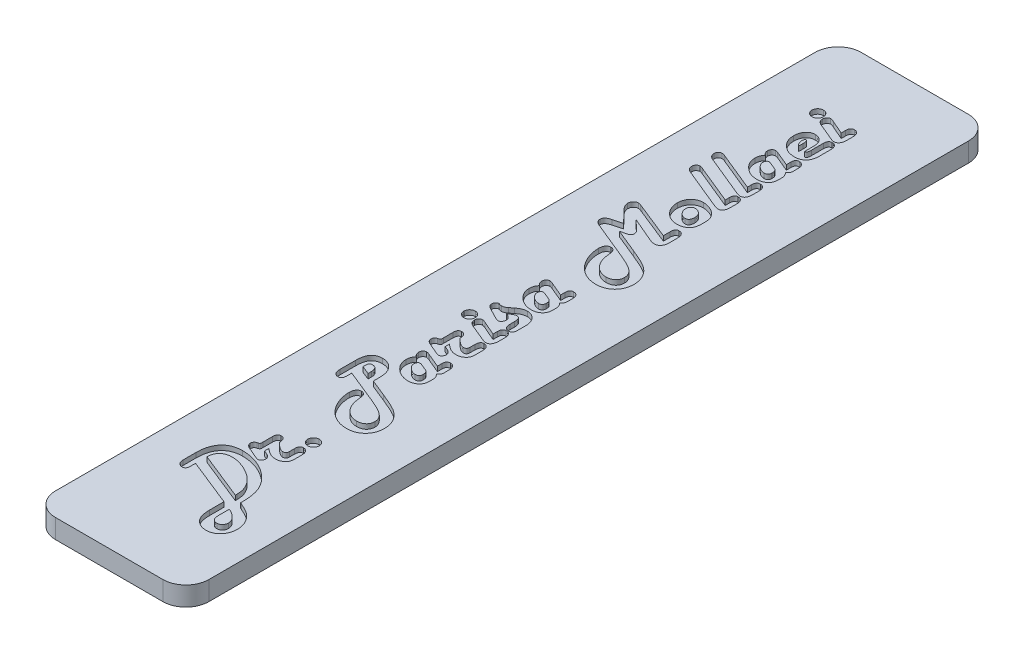
from build123d import *

# Parameters (mm, degrees)
BOSS_EXTRUDE1_DEPTH      = 66.675
BOSS_EXTRUDE1_DEPTH_BACK = 66.675
SKETCH3_W                = 25.4
SKETCH3_H                = 3.175
SKETCH5_OUTSIDE_W        = 54.556
SKETCH5_OUTSIDE_H        = 162.506
CUT_EXTRUDE2_DEPTH       = 68.947967225
CUT_EXTRUDE1_DEPTH       = 0.79375


with BuildPart() as part:
    # Sketch3 → Boss-Extrude1 (new, two sides: drawn at the far end of the back side and taken through both)
    with BuildSketch(Plane.XY.offset(-BOSS_EXTRUDE1_DEPTH_BACK)):
        Rectangle(SKETCH3_W, SKETCH3_H)
    extrude(amount=BOSS_EXTRUDE1_DEPTH + BOSS_EXTRUDE1_DEPTH_BACK)

    # Sketch5 outside → Cut-Extrude2 (cut, through all)
    with BuildSketch(Plane(origin=(0, 1.5875, 0), x_dir=(1, 0, 0), z_dir=(0, 1, 0))):
        Rectangle(SKETCH5_OUTSIDE_W, SKETCH5_OUTSIDE_H)
        with BuildLine():
            Line((12.7, -62.865), (12.7, 62.865))
            ThreePointArc((12.7, 62.865), (11.584076836, 65.559076836), (8.89, 66.675))
            Line((8.89, 66.675), (-8.89, 66.675))
            ThreePointArc((-8.89, 66.675), (-11.584076836, 65.559076836), (-12.7, 62.865))
            Line((-12.7, 62.865), (-12.7, -62.865))
            ThreePointArc((-12.7, -62.865), (-11.584076836, -65.559076836), (-8.89, -66.675))
            Line((-8.89, -66.675), (8.89, -66.675))
            ThreePointArc((8.89, -66.675), (11.584076836, -65.559076836), (12.7, -62.865))
        make_face(mode=Mode.SUBTRACT)
    extrude(amount=-CUT_EXTRUDE2_DEPTH, mode=Mode.SUBTRACT)

    # Sketch4 → Cut-Extrude1 (cut)
    # profile 1 of 18: a face of its own
    with BuildSketch(Plane(origin=(0, 1.5875, 0), x_dir=(1, 0, 0), z_dir=(0, 1, 0))):
        with BuildLine():
            Line((-5.059408711, -47.318193305), (-5.059408711, -47.979183542))
            Line((-5.059408711, -47.979183542), (-5.059408711, -48.159273696))
            add(Edge.make_bspline(
                [(-5.059408711, -48.159273696), (-5.061221798, -48.221393494), (-5.064618151, -48.337759031), (-5.091535017, -48.500685922), (-5.138308522, -48.640076097), (-5.205847499, -48.755291868), (-5.29318842, -48.846706358), (-5.402611201, -48.908842607), (-5.529823431, -48.947519978), (-5.621149297, -48.951023971), (-5.668944619, -48.952857783)],
                knots=[0, 0, 0, 0, 1.305737749, 2.445965353, 3.459324035, 4.379959175, 5.233349143, 6.085046436, 6.997810513, 8, 8, 8, 8], degree=3))
            add(Edge.make_bspline(
                [(-5.668944619, -48.952857783), (-5.731410963, -48.949144605), (-5.854689489, -48.941816576), (-6.031538734, -48.880305125), (-6.188487424, -48.77514435), (-6.326529965, -48.636685534), (-6.43823444, -48.468713276), (-6.52045023, -48.279202643), (-6.571281185, -48.07153893), (-6.576577835, -47.926702871), (-6.579290454, -47.85252673)],
                knots=[0, 0, 0, 0, 0.941902933, 1.858863449, 2.78744378, 3.773831386, 4.79357467, 5.815409039, 6.881186575, 8, 8, 8, 8], degree=3))
            Line((-6.579290454, -47.85252673), (-6.579290454, -47.672436576))
            Line((-6.579290454, -47.672436576), (-6.579290454, -45.71519303))
            add(Edge.make_bspline(
                [(-6.579290454, -45.71519303), (-6.576943694, -45.554129561), (-6.572385212, -45.241270552), (-6.528259255, -44.786826716), (-6.455923195, -44.361197646), (-6.353403231, -43.96451282), (-6.222361398, -43.596251008), (-6.065195062, -43.255021274), (-5.873740924, -42.945220738), (-5.655147073, -42.664114736), (-5.409385454, -42.413602623), (-5.136212127, -42.196312864), (-4.837107727, -42.01295585), (-4.511691276, -41.864600442), (-4.161606554, -41.747198521), (-3.786051006, -41.665355732), (-3.385240043, -41.614615135), (-3.109580017, -41.60943229), (-2.967592303, -41.606762695)],
                knots=[0, 0, 0, 0, 1.240121913, 2.408884614, 3.512215636, 4.562072732, 5.559962685, 6.519078054, 7.449661058, 8.358196616, 9.256317547, 10.145746268, 11.039719344, 11.951275398, 12.894325228, 13.877939151, 14.906963136, 16, 16, 16, 16], degree=3))
            add(Edge.make_bspline(
                [(-2.967592303, -41.606762695), (-2.747632965, -41.611808633), (-2.310664622, -41.621832828), (-1.662489052, -41.710976107), (-1.027874436, -41.850349753), (-0.407611195, -42.048006657), (0.198811118, -42.299891229), (0.789320154, -42.611388458), (1.369088674, -42.974791422), (1.733562556, -43.257969876), (1.918590017, -43.401727201)],
                knots=[0, 0, 0, 0, 0.99369571, 1.974062893, 2.951324249, 3.9272385, 4.912259598, 5.915104549, 6.941589699, 8, 8, 8, 8], degree=3))
            add(Edge.make_bspline(
                [(1.918590017, -43.401727201), (2.020560173, -43.486297762), (2.222042332, -43.653400177), (2.502478713, -43.92154895), (2.761785373, -44.196591081), (3.001726314, -44.47893737), (3.218070421, -44.771199908), (3.415328046, -45.070607648), (3.590018042, -45.378926089), (3.745118814, -45.696642047), (3.880396655, -46.026382489), (3.994887367, -46.371317009), (4.093794803, -46.731215244), (4.175487687, -47.107648794), (4.23491649, -47.499838023), (4.281986789, -47.906972367), (4.30655769, -48.330485422), (4.310957064, -48.618378226), (4.313195366, -48.764851578)],
                knots=[0, 0, 0, 0, 1.041972891, 2.058827374, 3.050103684, 4.014970579, 4.971989252, 5.909071109, 6.834104011, 7.757898592, 8.688895906, 9.635856426, 10.615406742, 11.624176682, 12.664286734, 13.734882699, 14.847559518, 16, 16, 16, 16], degree=3))
            Line((4.313195366, -48.764851578), (4.313195366, -49.235856597))
            Line((4.313195366, -49.235856597), (4.503180584, -49.316996117))
            add(Edge.make_bspline(
                [(4.503180584, -49.316996117), (4.588259484, -49.355294856), (4.751944871, -49.42897874), (4.988574197, -49.534757713), (5.203261613, -49.638569149), (5.399799285, -49.732963822), (5.57612167, -49.821755699), (5.731865259, -49.905364512), (5.86982203, -49.979512936), (6.025786476, -50.075392576), (6.206950257, -50.199429662), (6.417873247, -50.36160937), (6.623701124, -50.546054348), (6.754138311, -50.681025055), (6.820604438, -50.749801301)],
                knots=[0, 0, 0, 0, 1.222800361, 2.352575644, 3.396669397, 4.347862466, 5.210067408, 5.983579217, 6.664594993, 7.262130753, 8.381971782, 9.540587582, 10.746771362, 12, 12, 12, 12], degree=3))
            add(Edge.make_bspline(
                [(6.820604438, -50.749801301), (6.903395523, -50.843431472), (7.066380389, -51.027754469), (7.279287512, -51.324147077), (7.457034343, -51.631852787), (7.606030251, -51.948153751), (7.718433696, -52.276328041), (7.79973761, -52.61483842), (7.851106905, -52.963402117), (7.856747037, -53.19964347), (7.859586098, -53.318559767)],
                knots=[0, 0, 0, 0, 1.055914228, 2.078702545, 3.078046045, 4.055880218, 5.029205391, 6.004237832, 6.995397536, 8, 8, 8, 8], degree=3))
            add(Edge.make_bspline(
                [(7.859586098, -53.318559767), (7.856993501, -53.415601143), (7.851900251, -53.606242452), (7.821168372, -53.885345631), (7.764910307, -54.150747473), (7.687736712, -54.403224045), (7.588871721, -54.64338654), (7.467595534, -54.870169652), (7.324365245, -55.083000201), (7.160327756, -55.280311039), (6.979513426, -55.459422022), (6.785634375, -55.616630858), (6.578828947, -55.748534391), (6.361294215, -55.858555252), (6.129376676, -55.940743852), (5.887288606, -56.00326411), (5.632282094, -56.038964817), (5.458491616, -56.043387155), (5.36998814, -56.045639247)],
                knots=[0, 0, 0, 0, 1.126201464, 2.212463691, 3.25287726, 4.269850786, 5.272053028, 6.261782411, 7.249022054, 8.243830034, 9.23438794, 10.19795826, 11.134388982, 12.075812372, 13.02018767, 13.98375799, 14.973220915, 16, 16, 16, 16], degree=3))
            add(Edge.make_bspline(
                [(5.36998814, -56.045639247), (5.260123428, -56.042364412), (5.042463326, -56.035876423), (4.72333067, -55.967687567), (4.412900993, -55.868188347), (4.118355841, -55.723001093), (3.843725439, -55.544395888), (3.599045642, -55.333286533), (3.384255638, -55.093217354), (3.27040787, -54.912149748), (3.212864313, -54.820630395)],
                knots=[0, 0, 0, 0, 1.014242392, 2.009381349, 3.004557683, 4.021967388, 5.035219112, 6.025505851, 7.00200576, 8, 8, 8, 8], degree=3))
            add(Edge.make_bspline(
                [(3.212864313, -54.820630395), (3.178694237, -54.757216436), (3.108996627, -54.627869306), (3.024864607, -54.418622899), (2.954172904, -54.194057727), (2.894059757, -53.953683489), (2.850150029, -53.696845545), (2.815849805, -53.42421825), (2.796144893, -53.135465482), (2.794273346, -52.937299441), (2.793313624, -52.835680672)],
                knots=[0, 0, 0, 0, 0.84245226, 1.718372183, 2.633912599, 3.596293803, 4.615457363, 5.681185209, 6.810920853, 8, 8, 8, 8], degree=3))
            Line((2.793313624, -52.835680672), (2.793313624, -50.464823475))
            Line((2.793313624, -50.464823475), (-5.059408711, -47.318193305))
        make_face()
        with BuildLine():
            Line((2.793313624, -48.586740436), (2.793313624, -48.319573724))
            add(Edge.make_bspline(
                [(2.793313624, -48.319573724), (2.791702408, -48.233766534), (2.788512013, -48.063858273), (2.765744949, -47.811507558), (2.731199038, -47.564072804), (2.679029552, -47.322373474), (2.613727287, -47.086443378), (2.534611676, -46.855398595), (2.438580345, -46.63002763), (2.331215749, -46.408039814), (2.204488928, -46.193952462), (2.066703887, -45.983872572), (1.912916822, -45.77996721), (1.748048442, -45.579079754), (1.563156135, -45.387887424), (1.36913731, -45.196767106), (1.155852095, -45.015207226), (1.006709699, -44.899272873), (0.931062687, -44.840469423)],
                knots=[0, 0, 0, 0, 1.003752549, 1.98754731, 2.96218803, 3.924869515, 4.877913061, 5.824875223, 6.779479857, 7.742439712, 8.707376773, 9.687714611, 10.680189018, 11.694008127, 12.725763052, 13.790025714, 14.879071578, 16, 16, 16, 16], degree=3))
            add(Edge.make_bspline(
                [(0.931062687, -44.840469423), (0.78095443, -44.73119734), (0.481506127, -44.513212397), (0.004268718, -44.229830569), (-0.489791834, -43.978665221), (-0.997698155, -43.767843268), (-1.503867768, -43.596148627), (-1.997313923, -43.472046853), (-2.471672235, -43.394313509), (-2.782613813, -43.384657595), (-2.933949087, -43.379958061)],
                knots=[0, 0, 0, 0, 1.061151743, 2.116872814, 3.169496409, 4.227969904, 5.258553914, 6.222792805, 7.135033211, 8, 8, 8, 8], degree=3))
            add(Edge.make_bspline(
                [(-2.933949087, -43.379958061), (-3.013845359, -43.381246293), (-3.170118018, -43.383766001), (-3.398491181, -43.410246613), (-3.614094748, -43.452512821), (-3.815738777, -43.515098846), (-4.005154858, -43.591947883), (-4.182086066, -43.686912078), (-4.344678265, -43.800620492), (-4.494222588, -43.929111566), (-4.625964823, -44.074524963), (-4.744719615, -44.230605796), (-4.840786984, -44.401981463), (-4.920660454, -44.584315691), (-4.985190639, -44.778736923), (-5.026231366, -44.986931228), (-5.056449288, -45.206368104), (-5.058404564, -45.356877828), (-5.059408711, -45.434173229)],
                knots=[0, 0, 0, 0, 1.145531499, 2.240595844, 3.292755274, 4.292422607, 5.264114043, 6.220902991, 7.165828125, 8.104908158, 9.042461542, 9.975419986, 10.911970153, 11.852526766, 12.827988561, 13.843075609, 14.892295267, 16, 16, 16, 16], degree=3))
            Line((-5.059408711, -45.434173229), (2.793313624, -48.586740436))
        make_face(mode=Mode.SUBTRACT)
        with BuildLine():
            Line((4.313195366, -51.111960623), (4.313195366, -52.883176976))
            add(Edge.make_bspline(
                [(4.313195366, -52.883176976), (4.31614167, -52.98231026), (4.321654732, -53.16780635), (4.364073868, -53.427393718), (4.436805351, -53.649093206), (4.546252795, -53.829979233), (4.683522298, -53.974992099), (4.85579496, -54.075336794), (5.057259646, -54.136154641), (5.201313756, -54.142470056), (5.276974544, -54.145787069)],
                knots=[0, 0, 0, 0, 1.31364871, 2.458071474, 3.475829816, 4.38621616, 5.23967168, 6.094559773, 6.99921559, 8, 8, 8, 8], degree=3))
            add(Edge.make_bspline(
                [(5.276974544, -54.145787069), (5.340740764, -54.142634697), (5.46538183, -54.136472892), (5.642954311, -54.079945876), (5.806069188, -53.991857681), (5.945616014, -53.865872083), (6.065652646, -53.719041266), (6.151671976, -53.550443624), (6.2026179, -53.365678112), (6.209511273, -53.237743001), (6.213047544, -53.172112828)],
                knots=[0, 0, 0, 0, 1.015443884, 1.984844108, 2.946375274, 3.953924431, 4.965428653, 5.959234333, 6.953095811, 8, 8, 8, 8], degree=3))
            add(Edge.make_bspline(
                [(6.213047544, -53.172112828), (6.211514639, -53.121890807), (6.208451875, -53.021546581), (6.183926181, -52.872185228), (6.143090171, -52.724992439), (6.091088734, -52.578003726), (6.0182553, -52.434887921), (5.929850705, -52.294473491), (5.830080079, -52.152728936), (5.667591001, -51.969714475), (5.43470557, -51.747328301), (5.106825033, -51.508247505), (4.730688138, -51.290955227), (4.455753033, -51.173080371), (4.313195366, -51.111960623)],
                knots=[0, 0, 0, 0, 0.609246736, 1.21728261, 1.830931323, 2.461525313, 3.105941494, 3.774613737, 4.474427454, 5.206422339, 6.740961797, 8.372497183, 10.119089455, 12, 12, 12, 12], degree=3))
        make_face(mode=Mode.SUBTRACT)
    # profile 2 of 18: a face of its own
    with BuildSketch(Plane(origin=(0, 1.5875, 0), x_dir=(1, 0, 0), z_dir=(0, 1, 0))):
        with BuildLine():
            Line((-1.133047544, -39.815756215), (-0.590798068, -40.051258725))
            add(Edge.make_bspline(
                [(-0.590798068, -40.051258725), (-0.533457734, -40.077811653), (-0.424228786, -40.128392948), (-0.277391243, -40.218747888), (-0.150092315, -40.311205292), (-0.046402559, -40.412213595), (0.034874377, -40.520000501), (0.090963623, -40.635011921), (0.126477166, -40.755677992), (0.131161299, -40.838666098), (0.133520575, -40.88046504)],
                knots=[0, 0, 0, 0, 1.297501196, 2.471640463, 3.537215363, 4.524637192, 5.43567625, 6.296618738, 7.14205136, 8, 8, 8, 8], degree=3))
            add(Edge.make_bspline(
                [(0.133520575, -40.88046504), (0.132124839, -40.93017857), (0.129409557, -41.026891906), (0.093846564, -41.164374902), (0.040725262, -41.290909958), (-0.036730962, -41.399501819), (-0.126767084, -41.492231831), (-0.231464824, -41.559397709), (-0.348059997, -41.598267465), (-0.428897175, -41.603895559), (-0.470078294, -41.606762695)],
                knots=[0, 0, 0, 0, 1.131994738, 2.202197021, 3.220602635, 4.248319073, 5.22801886, 6.155513921, 7.060358075, 8, 8, 8, 8], degree=3))
            add(Edge.make_bspline(
                [(-0.470078294, -41.606762695), (-0.499218044, -41.604181333), (-0.566980404, -41.598178562), (-0.679647346, -41.568033845), (-0.816933777, -41.518918993), (-0.916176579, -41.478559089), (-0.970768504, -41.456357731)],
                knots=[0, 0, 0, 0, 0.667539348, 1.552314029, 2.65356594, 4, 4, 4, 4], degree=3))
            Line((-0.970768504, -41.456357731), (-2.763753997, -40.686521797))
            add(Edge.make_bspline(
                [(-2.763753997, -40.686521797), (-2.815170125, -40.663303946), (-2.913349865, -40.618969169), (-3.045413745, -40.536085284), (-3.158743629, -40.448299152), (-3.251729515, -40.351900969), (-3.324450011, -40.248772439), (-3.374003716, -40.136918816), (-3.408159145, -40.01896769), (-3.41128251, -39.936722846), (-3.412870157, -39.894916723)],
                knots=[0, 0, 0, 0, 1.242093141, 2.371792344, 3.427691145, 4.394328043, 5.313892613, 6.192305435, 7.081125362, 8, 8, 8, 8], degree=3))
            add(Edge.make_bspline(
                [(-3.412870157, -39.894916723), (-3.411163979, -39.854600688), (-3.407925024, -39.778066031), (-3.388612461, -39.668297343), (-3.353327552, -39.57098462), (-3.302774108, -39.485897906), (-3.238231802, -39.412504654), (-3.157775444, -39.353964488), (-3.064804408, -39.304471036), (-2.995783937, -39.284141845), (-2.959676252, -39.273506739)],
                knots=[0, 0, 0, 0, 1.15314347, 2.189090296, 3.173792814, 4.095790583, 5.004376053, 5.947550008, 6.926271946, 8, 8, 8, 8], degree=3))
            Line((-2.959676252, -39.273506739), (-2.759795971, -39.218094384))
            add(Edge.make_bspline(
                [(-2.759795971, -39.218094384), (-2.735748973, -39.211682549), (-2.691703864, -39.199938464), (-2.634585283, -39.17176141), (-2.59151934, -39.138757665), (-2.560947532, -39.094229227), (-2.544747313, -39.031638519), (-2.534309592, -38.94469205), (-2.526479032, -38.829003766), (-2.526345982, -38.741822505), (-2.526272474, -38.693656023)],
                knots=[0, 0, 0, 0, 0.926850573, 1.697643703, 2.362895762, 2.92973869, 3.677374781, 4.746381598, 6.202419277, 8, 8, 8, 8], degree=3))
            Line((-2.526272474, -38.693656023), (-2.526272474, -37.130236001))
            add(Edge.make_bspline(
                [(-2.526272474, -37.130236001), (-2.524532467, -37.064152041), (-2.521278246, -36.940559591), (-2.493558114, -36.767555152), (-2.449642601, -36.620002319), (-2.386772452, -36.496821024), (-2.300876341, -36.402494876), (-2.196591421, -36.335236896), (-2.07396949, -36.294470895), (-1.986325506, -36.289681575), (-1.940484719, -36.287176597)],
                knots=[0, 0, 0, 0, 1.361355543, 2.546053047, 3.599677592, 4.524244374, 5.371169927, 6.197098625, 7.057021238, 8, 8, 8, 8], degree=3))
            add(Edge.make_bspline(
                [(-1.940484719, -36.287176597), (-1.876704344, -36.289422476), (-1.755337885, -36.293696115), (-1.587019418, -36.347468603), (-1.441985775, -36.431596607), (-1.327816684, -36.555834272), (-1.236574655, -36.710527962), (-1.175701967, -36.899574633), (-1.138009761, -37.1208109), (-1.134775851, -37.279142143), (-1.133047544, -37.363759498)],
                knots=[0, 0, 0, 0, 0.994284648, 1.892005291, 2.734571892, 3.588753721, 4.500369607, 5.525254763, 6.677415825, 8, 8, 8, 8], degree=3))
            Line((-1.133047544, -37.363759498), (-1.067740125, -37.433024942))
            add(Edge.make_bspline(
                [(-1.067740125, -37.433024942), (-0.987921256, -37.512211231), (-0.835136029, -37.663785604), (-0.60704457, -37.869059885), (-0.391993659, -38.042321976), (-0.193594409, -38.186696878), (-0.006185567, -38.296645811), (0.165468107, -38.376902349), (0.324390219, -38.429749535), (0.42739902, -38.436951921), (0.475889769, -38.440342399)],
                knots=[0, 0, 0, 0, 1.435762249, 2.748263184, 3.91660617, 4.961556361, 5.879059361, 6.685751502, 7.381325737, 8, 8, 8, 8], degree=3))
            add(Edge.make_bspline(
                [(0.475889769, -38.440342399), (0.518360985, -38.439503036), (0.59906364, -38.437908102), (0.710559399, -38.407756726), (0.809251217, -38.369095719), (0.88615109, -38.304001211), (0.948196196, -38.224307241), (0.990380475, -38.126260419), (1.017109736, -38.011648691), (1.019069792, -37.929930971), (1.020118258, -37.886218847)],
                knots=[0, 0, 0, 0, 1.140484469, 2.167117703, 3.098941929, 3.971150526, 4.846255631, 5.80154673, 6.824011975, 8, 8, 8, 8], degree=3))
            Line((1.020118258, -37.886218847), (1.020118258, -37.043159443))
            add(Edge.make_bspline(
                [(1.020118258, -37.043159443), (1.021984217, -36.97381807), (1.025466972, -36.844394519), (1.051533923, -36.662689084), (1.100887158, -36.50903494), (1.167116652, -36.380975225), (1.255478016, -36.281387012), (1.363636668, -36.209984002), (1.492717348, -36.167292726), (1.585120442, -36.162850827), (1.63361219, -36.160519785)],
                knots=[0, 0, 0, 0, 1.364190584, 2.546219988, 3.596843527, 4.525897283, 5.362221888, 6.186477391, 7.048290713, 8, 8, 8, 8], degree=3))
            add(Edge.make_bspline(
                [(1.63361219, -36.160519785), (1.70200856, -36.164102344), (1.833530254, -36.170991367), (2.018290659, -36.2298759), (2.178749377, -36.327635679), (2.309797916, -36.466222869), (2.41659376, -36.636566386), (2.487295379, -36.840929259), (2.534438198, -37.072666456), (2.538083095, -37.237493987), (2.54, -37.324179244)],
                knots=[0, 0, 0, 0, 0.982615473, 1.889504555, 2.759142238, 3.658944971, 4.610088785, 5.631441668, 6.75433984, 8, 8, 8, 8], degree=3))
            Line((2.54, -37.324179244), (2.54, -38.634285642))
            add(Edge.make_bspline(
                [(2.54, -38.634285642), (2.538430408, -38.686485752), (2.535356682, -38.788709026), (2.512617758, -38.938443213), (2.478022786, -39.081579547), (2.425832595, -39.216747994), (2.359635976, -39.344452552), (2.280705326, -39.46623037), (2.184687895, -39.578862664), (2.076052454, -39.683725598), (1.955607585, -39.777853645), (1.827028716, -39.861788872), (1.68869591, -39.93125516), (1.5424848, -39.988906008), (1.386467302, -40.032252314), (1.222288609, -40.063333731), (1.049676112, -40.084195762), (0.931785098, -40.08597435), (0.871692306, -40.086880953)],
                knots=[0, 0, 0, 0, 1.009407673, 1.976719137, 2.923785669, 3.852797958, 4.771676065, 5.702527031, 6.65345443, 7.628144937, 8.618662201, 9.606215811, 10.593522047, 11.607757909, 12.641947342, 13.720607507, 14.838121302, 16, 16, 16, 16], degree=3))
            add(Edge.make_bspline(
                [(0.871692306, -40.086880953), (0.793683688, -40.084074204), (0.637343317, -40.078449079), (0.405084974, -40.037141444), (0.175746401, -39.972141902), (-0.053629714, -39.875737901), (-0.292447526, -39.744174088), (-0.551427767, -39.574277568), (-0.835914279, -39.363711462), (-1.030170108, -39.205115052), (-1.133047544, -39.121122763)],
                knots=[0, 0, 0, 0, 0.822710096, 1.64882809, 2.481516469, 3.333299355, 4.267584386, 5.354441073, 6.598918144, 8, 8, 8, 8], degree=3))
            Line((-1.133047544, -39.121122763), (-1.133047544, -39.815756215))
        make_face()
    # profile 3 of 18: a face of its own
    with BuildSketch(Plane(origin=(0, 1.5875, 0), x_dir=(1, 0, 0), z_dir=(0, 1, 0))):
        with BuildLine():
            add(Edge.make_bspline(
                [(0.766804634, -34.573351612), (0.770139014, -34.510295609), (0.776646221, -34.387238683), (0.830830714, -34.209885762), (0.91939683, -34.046761942), (1.042292932, -33.902871846), (1.186183028, -33.779975744), (1.349306847, -33.691409628), (1.526659768, -33.637225135), (1.649716695, -33.630717928), (1.712772698, -33.627383548)],
                knots=[0, 0, 0, 0, 1.018015329, 1.986707578, 2.970091954, 4, 5.029908046, 6.013292422, 6.981984671, 8, 8, 8, 8], degree=3))
            add(Edge.make_bspline(
                [(1.712772698, -33.627383548), (1.776467102, -33.630792426), (1.901411116, -33.637479339), (2.081524984, -33.691000013), (2.246960005, -33.779399256), (2.391134327, -33.902925637), (2.514073317, -34.046748252), (2.602628499, -34.209889276), (2.656815813, -34.387237758), (2.663322631, -34.510295296), (2.666656812, -34.573351612)],
                knots=[0, 0, 0, 0, 1.023458974, 2.007634331, 2.995409192, 4.02013336, 5.044857529, 6.023292197, 6.987108688, 8, 8, 8, 8], degree=3))
            add(Edge.make_bspline(
                [(2.666656812, -34.573351612), (2.663248136, -34.637046335), (2.656561621, -34.761990974), (2.603038054, -34.942100289), (2.514649886, -35.107552743), (2.391080568, -35.251659482), (2.246973829, -35.375228801), (2.081521375, -35.463616968), (1.901412059, -35.517140535), (1.77646742, -35.52382705), (1.712772698, -35.527235726)],
                knots=[0, 0, 0, 0, 1.018333356, 1.997579833, 2.980407786, 4, 5.019592214, 6.002420167, 6.981666644, 8, 8, 8, 8], degree=3))
            add(Edge.make_bspline(
                [(1.712772698, -35.527235726), (1.649716382, -35.523901546), (1.526658843, -35.517394727), (1.349310361, -35.463207413), (1.186169337, -35.374652232), (1.042346723, -35.251713241), (0.918820342, -35.10753892), (0.830421099, -34.942103898), (0.776900424, -34.761990031), (0.770213512, -34.637046016), (0.766804634, -34.573351612)],
                knots=[0, 0, 0, 0, 1.012891312, 1.976707803, 2.955142471, 3.97986664, 5.004590808, 5.992365669, 6.976541026, 8, 8, 8, 8], degree=3))
        make_face()
    # profile 4 of 18: a face of its own
    with BuildSketch(Plane(origin=(0, 1.5875, 0), x_dir=(1, 0, 0), z_dir=(0, 1, 0))):
        with BuildLine():
            Line((-2.146302039, -20.811297398), (0.624315721, -21.923502528))
            add(Edge.make_bspline(
                [(0.624315721, -21.923502528), (0.789377123, -21.99043999), (1.106234776, -22.11893549), (1.559915681, -22.30939548), (1.973708728, -22.487157248), (2.347752684, -22.653432617), (2.683015178, -22.806875062), (2.976686795, -22.951311257), (3.231257431, -23.081606027), (3.51587663, -23.23843411), (3.832787043, -23.442823713), (4.180178167, -23.714627488), (4.500038527, -24.016062453), (4.688000123, -24.239664183), (4.782221372, -24.351751092)],
                knots=[0, 0, 0, 0, 1.316025526, 2.52628873, 3.635396764, 4.643473973, 5.550686247, 6.359394249, 7.061322966, 7.663498093, 8.7599393, 9.843181906, 10.918831827, 12, 12, 12, 12], degree=3))
            add(Edge.make_bspline(
                [(4.782221372, -24.351751092), (4.845627918, -24.436541651), (4.971126534, -24.604364985), (5.133970193, -24.871878706), (5.273128552, -25.147996662), (5.384346469, -25.436023665), (5.471355875, -25.733338502), (5.534883174, -26.040963102), (5.573553013, -26.358795048), (5.577676538, -26.574073843), (5.579763485, -26.683028036)],
                knots=[0, 0, 0, 0, 1.011044617, 2.001129376, 2.987597007, 3.961339675, 4.946518016, 5.943976879, 6.959431467, 8, 8, 8, 8], degree=3))
            add(Edge.make_bspline(
                [(5.579763485, -26.683028036), (5.57731332, -26.797301048), (5.572523406, -27.020697431), (5.528900147, -27.346940301), (5.463620918, -27.657873076), (5.364926237, -27.951480716), (5.243100823, -28.230277771), (5.09093589, -28.491237216), (4.912475782, -28.735880033), (4.706461454, -28.960420037), (4.480218246, -29.163947213), (4.23488457, -29.340769099), (3.974444442, -29.492907797), (3.696034453, -29.615361821), (3.401625809, -29.710919897), (3.09116848, -29.777000284), (2.764849632, -29.820389756), (2.541463861, -29.825212325), (2.427196277, -29.827679193)],
                knots=[0, 0, 0, 0, 1.095039877, 2.140732475, 3.150521304, 4.13652018, 5.104897175, 6.062745876, 7.026672252, 8.00261995, 8.979018386, 9.939223627, 10.897072327, 11.865449322, 12.849478696, 13.859267525, 14.904960123, 16, 16, 16, 16], degree=3))
            add(Edge.make_bspline(
                [(2.427196277, -29.827679193), (2.273271358, -29.823457391), (1.969377772, -29.815122298), (1.52113617, -29.749931997), (1.087796145, -29.643773033), (0.669674658, -29.490799468), (0.264598292, -29.299901992), (-0.123230491, -29.061057463), (-0.497388389, -28.781900427), (-0.728581178, -28.567285717), (-0.846090705, -28.458202414)],
                knots=[0, 0, 0, 0, 1.013796752, 2.00153641, 2.977647105, 3.948285219, 4.930040032, 5.922901228, 6.94426252, 8, 8, 8, 8], degree=3))
            add(Edge.make_bspline(
                [(-0.846090705, -28.458202414), (-0.908233874, -28.39561412), (-1.033666244, -28.269283293), (-1.208089414, -28.06525048), (-1.375458314, -27.851287), (-1.53159151, -27.624600934), (-1.679721911, -27.387679083), (-1.819553342, -27.139249979), (-1.946587619, -26.877879983), (-2.107410418, -26.519691049), (-2.273511197, -26.06231347), (-2.419472708, -25.508840508), (-2.507911782, -24.956213846), (-2.520173583, -24.588220482), (-2.526272474, -24.405184435)],
                knots=[0, 0, 0, 0, 0.706169296, 1.425361597, 2.148231665, 2.881015689, 3.628657503, 4.385575625, 5.162942875, 5.955265483, 7.529696308, 9.053365446, 10.534374814, 12, 12, 12, 12], degree=3))
            add(Edge.make_bspline(
                [(-2.526272474, -24.405184435), (-2.52435614, -24.32177917), (-2.520688649, -24.162157771), (-2.472662338, -23.93682836), (-2.403779561, -23.734185165), (-2.299692161, -23.561787516), (-2.173947777, -23.418608011), (-2.024224345, -23.314527033), (-1.854112317, -23.252035451), (-1.734527864, -23.24508341), (-1.673318007, -23.241524976)],
                knots=[0, 0, 0, 0, 1.238099196, 2.369480208, 3.412225081, 4.406632522, 5.344448297, 6.226188743, 7.092066479, 8, 8, 8, 8], degree=3))
            add(Edge.make_bspline(
                [(-1.673318007, -23.241524976), (-1.608766585, -23.245585614), (-1.482919216, -23.253502103), (-1.304118815, -23.319911163), (-1.147235277, -23.432236885), (-1.066136078, -23.53350839), (-1.024201846, -23.585873183)],
                knots=[0, 0, 0, 0, 1.010937669, 1.970891475, 2.950802117, 4, 4, 4, 4], degree=3))
            add(Edge.make_bspline(
                [(-1.024201846, -23.585873183), (-1.000208251, -23.626050426), (-0.946169923, -23.716537534), (-0.8950237, -23.888249335), (-0.852084744, -24.102107936), (-0.835395033, -24.261136303), (-0.826300578, -24.347793067)],
                knots=[0, 0, 0, 0, 0.704559972, 1.586808607, 2.68501851, 4, 4, 4, 4], degree=3))
            add(Edge.make_bspline(
                [(-0.826300578, -24.347793067), (-0.815523738, -24.454801316), (-0.794507324, -24.663483045), (-0.745268421, -24.967515516), (-0.689976017, -25.256836527), (-0.617775867, -25.529853851), (-0.536352927, -25.787986197), (-0.447205222, -26.031893621), (-0.341250788, -26.258528589), (-0.261788872, -26.401128874), (-0.222701709, -26.471273678)],
                knots=[0, 0, 0, 0, 1.159710426, 2.261604866, 3.320677166, 4.335395728, 5.305245955, 6.239579045, 7.134052342, 8, 8, 8, 8], degree=3))
            add(Edge.make_bspline(
                [(-0.222701709, -26.471273678), (-0.152857084, -26.580129843), (-0.015266807, -26.794570826), (0.236945987, -27.07961603), (0.51709467, -27.331184911), (0.826540541, -27.54381084), (1.155939902, -27.7136434), (1.497291846, -27.838244802), (1.848578131, -27.914608241), (2.086435705, -27.923416255), (2.205546856, -27.927827015)],
                knots=[0, 0, 0, 0, 1.047576128, 2.063670475, 3.075290511, 4.094745252, 5.099666308, 6.072755065, 7.034899922, 8, 8, 8, 8], degree=3))
            add(Edge.make_bspline(
                [(2.205546856, -27.927827015), (2.264967465, -27.926746755), (2.381446153, -27.924629187), (2.551433222, -27.906327934), (2.712747882, -27.877825272), (2.863193073, -27.833253725), (3.005140482, -27.779850181), (3.138752442, -27.715195027), (3.260797004, -27.634904177), (3.37509624, -27.546561242), (3.474989116, -27.444737835), (3.56538003, -27.336891885), (3.63830379, -27.217976281), (3.700997148, -27.092740778), (3.747816582, -26.958194522), (3.781184235, -26.815553243), (3.804421175, -26.665315476), (3.80584261, -26.561740303), (3.806568119, -26.508874919)],
                knots=[0, 0, 0, 0, 1.180906515, 2.314860832, 3.395146952, 4.432720844, 5.428859457, 6.408284318, 7.375873327, 8.328235049, 9.274073667, 10.205991361, 11.119268818, 12.040047653, 12.985704432, 13.943108951, 14.9501506, 16, 16, 16, 16], degree=3))
            add(Edge.make_bspline(
                [(3.806568119, -26.508874919), (3.805095948, -26.441422973), (3.802189936, -26.308275294), (3.766169898, -26.113403617), (3.713226389, -25.925245722), (3.637019696, -25.744106302), (3.539785801, -25.569359951), (3.420064308, -25.402261791), (3.277859513, -25.243454366), (3.113273052, -25.088773815), (2.919188065, -24.938306947), (2.697681308, -24.780411079), (2.43929783, -24.624526196), (2.149517135, -24.46097304), (1.825046746, -24.296670863), (1.468320136, -24.125043093), (1.076168511, -23.954861462), (0.803223627, -23.840830541), (0.661916962, -23.781795439)],
                knots=[0, 0, 0, 0, 0.731676688, 1.444303058, 2.145016375, 2.851566032, 3.573211535, 4.312808279, 5.079163071, 5.88508809, 6.762346765, 7.744328667, 8.837972341, 10.037711651, 11.357883797, 12.787164715, 14.33667869, 16, 16, 16, 16], degree=3))
            Line((0.661916962, -23.781795439), (-5.059408711, -21.458434546))
            Line((-5.059408711, -21.458434546), (-5.059408711, -22.186711215))
            add(Edge.make_bspline(
                [(-5.059408711, -22.186711215), (-5.061216496, -22.259372045), (-5.064600783, -22.395397738), (-5.091466288, -22.585731619), (-5.137339102, -22.74816422), (-5.204622605, -22.881960347), (-5.291856035, -22.987637196), (-5.400196816, -23.063445887), (-5.529078586, -23.108308478), (-5.621085731, -23.112623593), (-5.668944619, -23.114868164)],
                knots=[0, 0, 0, 0, 1.386647813, 2.595892835, 3.659749566, 4.594681301, 5.434731623, 6.248703716, 7.089037154, 8, 8, 8, 8], degree=3))
            add(Edge.make_bspline(
                [(-5.668944619, -23.114868164), (-5.73742889, -23.111633287), (-5.869533997, -23.105393258), (-6.055030485, -23.041008148), (-6.216588679, -22.937270298), (-6.350964412, -22.791458222), (-6.452989563, -22.606810086), (-6.528293171, -22.39084331), (-6.570403761, -22.141474753), (-6.576217316, -21.965219527), (-6.579290454, -21.872048198)],
                knots=[0, 0, 0, 0, 0.942409434, 1.817893302, 2.674221847, 3.569887169, 4.524363572, 5.567001171, 6.713877944, 8, 8, 8, 8], degree=3))
            Line((-6.579290454, -21.872048198), (-6.579290454, -19.329016897))
            add(Edge.make_bspline(
                [(-6.579290454, -19.329016897), (-6.577756358, -19.224081561), (-6.574781195, -19.020574173), (-6.552376986, -18.726028855), (-6.519213577, -18.451722226), (-6.464030506, -18.200476266), (-6.400871522, -17.969102802), (-6.31857222, -17.760246031), (-6.224757328, -17.570628779), (-6.112727652, -17.402642114), (-5.986034342, -17.255384129), (-5.842915791, -17.128223941), (-5.683340413, -17.02150885), (-5.509186716, -16.931760008), (-5.318033771, -16.86401738), (-5.111291989, -16.817977116), (-4.888814562, -16.787080053), (-4.734961223, -16.783745606), (-4.655690124, -16.782027571)],
                knots=[0, 0, 0, 0, 1.377779469, 2.672010327, 3.877566876, 5.002296731, 6.047021908, 7.023471041, 7.945492411, 8.820022801, 9.667536142, 10.489793169, 11.325896471, 12.182086672, 13.056145004, 13.980726477, 14.959593374, 16, 16, 16, 16], degree=3))
            add(Edge.make_bspline(
                [(-4.655690124, -16.782027571), (-4.557912888, -16.785319793), (-4.365993375, -16.791781847), (-4.084683535, -16.835267102), (-3.817914581, -16.911292436), (-3.564028538, -17.016215416), (-3.326024857, -17.154600104), (-3.100061644, -17.320586061), (-2.887100772, -17.516208797), (-2.762063453, -17.667071395), (-2.698446578, -17.743827736)],
                knots=[0, 0, 0, 0, 1.037190231, 2.03582197, 3.010506387, 3.973515094, 4.942177049, 5.923321209, 6.943420921, 8, 8, 8, 8], degree=3))
            add(Edge.make_bspline(
                [(-2.698446578, -17.743827736), (-2.654093198, -17.804888188), (-2.56303112, -17.930251612), (-2.45130456, -18.1421856), (-2.356121334, -18.376923525), (-2.280061128, -18.635783179), (-2.218749318, -18.916784329), (-2.175853562, -19.221707919), (-2.15003315, -19.550212376), (-2.147573198, -19.777543234), (-2.146302039, -19.895014525)],
                knots=[0, 0, 0, 0, 0.800437442, 1.643380872, 2.535600309, 3.486195869, 4.50417187, 5.586788071, 6.752993229, 8, 8, 8, 8], degree=3))
            Line((-2.146302039, -19.895014525), (-2.146302039, -20.811297398))
        make_face()
        with BuildLine():
            Line((-3.666183781, -20.162181238), (-3.666183781, -19.621910775))
            add(Edge.make_bspline(
                [(-3.666183781, -19.621910775), (-3.66854018, -19.538610424), (-3.67298768, -19.381388161), (-3.713426923, -19.161936958), (-3.782586096, -18.97470374), (-3.880359248, -18.819933344), (-4.009115314, -18.698054298), (-4.16839241, -18.615550687), (-4.352755836, -18.561631615), (-4.485073477, -18.557433785), (-4.554760477, -18.555222937)],
                knots=[0, 0, 0, 0, 1.258971058, 2.376199826, 3.358208907, 4.260347007, 5.121448143, 6.005251248, 6.949436718, 8, 8, 8, 8], degree=3))
            add(Edge.make_bspline(
                [(-4.554760477, -18.555222937), (-4.594477208, -18.557121762), (-4.669717665, -18.560718949), (-4.77533876, -18.587442844), (-4.86329517, -18.637299366), (-4.93797113, -18.704142796), (-4.992171605, -18.793512106), (-5.032495741, -18.899336714), (-5.055603233, -19.023934763), (-5.058085408, -19.113207508), (-5.059408711, -19.160800819)],
                knots=[0, 0, 0, 0, 1.057975811, 2.004258143, 2.869579862, 3.727735231, 4.644179764, 5.623179532, 6.73286349, 8, 8, 8, 8], degree=3))
            Line((-5.059408711, -19.160800819), (-5.059408711, -19.608057686))
            Line((-5.059408711, -19.608057686), (-3.666183781, -20.162181238))
        make_face(mode=Mode.SUBTRACT)
    # profile 5 of 18: a face of its own
    with BuildSketch(Plane(origin=(0, 1.5875, 0), x_dir=(1, 0, 0), z_dir=(0, 1, 0))):
        with BuildLine():
            Line((1.020118258, -13.366251676), (1.020118258, -12.630058957))
            add(Edge.make_bspline(
                [(1.020118258, -12.630058957), (1.022030585, -12.568624398), (1.025630745, -12.45296728), (1.051643367, -12.290184609), (1.101010548, -12.152062323), (1.168396858, -12.03768899), (1.256589291, -11.948625049), (1.365212679, -11.886341038), (1.493175549, -11.847584726), (1.585158661, -11.844196637), (1.63361219, -11.842411909)],
                knots=[0, 0, 0, 0, 1.294659495, 2.437334719, 3.457519937, 4.368220716, 5.213556601, 6.067082152, 6.981805575, 8, 8, 8, 8], degree=3))
            add(Edge.make_bspline(
                [(1.63361219, -11.842411909), (1.701266236, -11.845517015), (1.831002227, -11.851471485), (2.014642077, -11.90582151), (2.172462239, -11.999489616), (2.305637414, -12.126922268), (2.40995049, -12.285820933), (2.489629362, -12.471433973), (2.530613014, -12.686365643), (2.536772349, -12.837708319), (2.54, -12.917015797)],
                knots=[0, 0, 0, 0, 1.020499011, 1.956948009, 2.859423251, 3.7687511, 4.716847855, 5.712717295, 6.801404681, 8, 8, 8, 8], degree=3))
            Line((2.54, -12.917015797), (2.54, -13.771949277))
            add(Edge.make_bspline(
                [(2.54, -13.771949277), (2.538441815, -13.818203184), (2.535462365, -13.906646567), (2.513879543, -14.034124716), (2.475293112, -14.149443107), (2.425610674, -14.256577691), (2.353294927, -14.347271863), (2.272096342, -14.430559895), (2.173506491, -14.50074618), (2.099299197, -14.535671233), (2.06107893, -14.553659288)],
                knots=[0, 0, 0, 0, 1.135251448, 2.170745912, 3.158955961, 4.114801062, 5.050690111, 5.989515837, 6.964505536, 8, 8, 8, 8], degree=3))
            add(Edge.make_bspline(
                [(2.06107893, -14.553659288), (2.133810309, -14.633969843), (2.271082801, -14.785547198), (2.423139189, -15.032924139), (2.521558028, -15.278078761), (2.533987947, -15.443409157), (2.54, -15.523375503)],
                knots=[0, 0, 0, 0, 1.172002926, 2.212026842, 3.135200271, 4, 4, 4, 4], degree=3))
            Line((2.54, -15.523375503), (2.54, -16.283316374))
            add(Edge.make_bspline(
                [(2.54, -16.283316374), (2.538569993, -16.343430353), (2.535776775, -16.460850399), (2.51126098, -16.632556877), (2.472087508, -16.795134925), (2.416594304, -16.949634062), (2.342571826, -17.093492375), (2.255069088, -17.230513654), (2.149520553, -17.35617313), (2.030994005, -17.473806907), (1.897774304, -17.577562448), (1.75590598, -17.671750244), (1.601955477, -17.748660997), (1.439009344, -17.812352355), (1.266610844, -17.861236546), (1.084783687, -17.897874524), (0.892528329, -17.916484714), (0.760900247, -17.920093316), (0.693581165, -17.921938878)],
                knots=[0, 0, 0, 0, 1.038806976, 2.029091485, 2.99167023, 3.926069813, 4.859424868, 5.783114847, 6.730782711, 7.690452028, 8.664715101, 9.645298791, 10.629655371, 11.633506053, 12.665844953, 13.723757455, 14.835852066, 16, 16, 16, 16], degree=3))
            add(Edge.make_bspline(
                [(0.693581165, -17.921938878), (0.590524348, -17.919372897), (0.386854996, -17.914301795), (0.085409439, -17.870844677), (-0.207647045, -17.80228436), (-0.492621894, -17.704504956), (-0.768103378, -17.578515647), (-1.037245398, -17.428673188), (-1.294941714, -17.245689991), (-1.543006347, -17.041305119), (-1.771410212, -16.818905963), (-1.973489991, -16.586859839), (-2.142905013, -16.345877322), (-2.28193218, -16.097783893), (-2.392708989, -15.842994628), (-2.470056645, -15.579828311), (-2.516740579, -15.309327851), (-2.523085265, -15.126434566), (-2.526272474, -15.03455937)],
                knots=[0, 0, 0, 0, 1.038436407, 2.05224338, 3.063582843, 4.068804017, 5.083657321, 6.113884954, 7.169134107, 8.264944544, 9.351250422, 10.379092992, 11.362431842, 12.315140492, 13.241586482, 14.156891473, 15.074126981, 16, 16, 16, 16], degree=3))
            add(Edge.make_bspline(
                [(-2.526272474, -15.03455937), (-2.524599435, -14.965912636), (-2.521357125, -14.832876854), (-2.500779324, -14.639703545), (-2.46033774, -14.461107176), (-2.407677152, -14.296374286), (-2.340197419, -14.14569023), (-2.256205945, -14.010209392), (-2.157770241, -13.887420958), (-2.078829362, -13.819631473), (-2.039435354, -13.785802366)],
                knots=[0, 0, 0, 0, 1.187941941, 2.302203992, 3.354530118, 4.350764151, 5.29067738, 6.202947275, 7.103213569, 8, 8, 8, 8], degree=3))
            add(Edge.make_bspline(
                [(-2.039435354, -13.785802366), (-2.078373828, -13.757616232), (-2.154015621, -13.702861911), (-2.253370953, -13.60893547), (-2.338288009, -13.509457492), (-2.405462198, -13.401437573), (-2.459196077, -13.287899438), (-2.500041354, -13.168765383), (-2.521350618, -13.041795027), (-2.524605646, -12.955346929), (-2.526272474, -12.911078759)],
                knots=[0, 0, 0, 0, 1.103205467, 2.143084487, 3.132610165, 4.099600995, 5.055365417, 6.013769083, 6.982894815, 8, 8, 8, 8], degree=3))
            add(Edge.make_bspline(
                [(-2.526272474, -12.911078759), (-2.523914733, -12.864048678), (-2.519301789, -12.77203388), (-2.485690223, -12.640756862), (-2.428368911, -12.521758861), (-2.349378043, -12.417896968), (-2.253875211, -12.330768767), (-2.14424424, -12.268343503), (-2.02439242, -12.228014992), (-1.940154896, -12.224292001), (-1.89694644, -12.222382344)],
                knots=[0, 0, 0, 0, 1.08453349, 2.121900051, 3.102199503, 4.112869643, 5.115253576, 6.062989376, 7.006437589, 8, 8, 8, 8], degree=3))
            add(Edge.make_bspline(
                [(-1.89694644, -12.222382344), (-1.865195022, -12.223540547), (-1.797835637, -12.225997628), (-1.693070918, -12.247430403), (-1.579757849, -12.281053652), (-1.503514939, -12.312672203), (-1.463542662, -12.329249029)],
                knots=[0, 0, 0, 0, 0.847236183, 1.797378234, 2.845219729, 4, 4, 4, 4], degree=3))
            Line((-1.463542662, -12.329249029), (-1.287410533, -12.402472499))
            Line((-1.287410533, -12.402472499), (1.020118258, -13.366251676))
        make_face()
        with BuildLine():
            Line((1.020118258, -15.790542216), (1.020118258, -15.622326138))
            add(Edge.make_bspline(
                [(1.020118258, -15.622326138), (1.019190974, -15.580031839), (1.017397609, -15.498234784), (0.997696115, -15.380920937), (0.963876331, -15.275169467), (0.918047982, -15.179893518), (0.858222777, -15.096491898), (0.785885571, -15.023613801), (0.698981812, -14.963417218), (0.634065585, -14.933325516), (0.600567568, -14.917797622)],
                knots=[0, 0, 0, 0, 1.157664044, 2.238919033, 3.244614913, 4.190073881, 5.122668863, 6.042574887, 6.989931157, 8, 8, 8, 8], degree=3))
            Line((0.600567568, -14.917797622), (-0.483931383, -14.466582729))
            add(Edge.make_bspline(
                [(-0.483931383, -14.466582729), (-0.547634922, -14.439605353), (-0.66198574, -14.391179708), (-0.78546382, -14.380346359), (-0.840153666, -14.375548146)],
                knots=[0, 0, 0, 0, 1.114177243, 2, 2, 2, 2], degree=3))
            add(Edge.make_bspline(
                [(-0.840153666, -14.375548146), (-0.867445712, -14.378209846), (-0.922502564, -14.383579352), (-1.003351494, -14.41649726), (-1.073978503, -14.476987575), (-1.138514854, -14.553987436), (-1.194180753, -14.645448519), (-1.230344878, -14.750238232), (-1.255814185, -14.862489295), (-1.258379754, -14.940730274), (-1.259704356, -14.981126028)],
                knots=[0, 0, 0, 0, 0.809745278, 1.63351721, 2.536886947, 3.535238575, 4.604334403, 5.686212968, 6.805393632, 8, 8, 8, 8], degree=3))
            add(Edge.make_bspline(
                [(-1.259704356, -14.981126028), (-1.258318271, -15.022165111), (-1.255518899, -15.105048714), (-1.228071958, -15.227962134), (-1.186468428, -15.349551681), (-1.127550063, -15.470207057), (-1.05234784, -15.589997886), (-0.960809152, -15.709792031), (-0.85044799, -15.825946684), (-0.688559013, -15.978366705), (-0.470355852, -16.142990871), (-0.194524277, -16.290628927), (0.087994121, -16.384246901), (0.279958229, -16.396160946), (0.374960122, -16.402057136)],
                knots=[0, 0, 0, 0, 0.627706518, 1.267732443, 1.919531944, 2.592823818, 3.31892668, 4.082778462, 4.897707917, 5.769757387, 7.487317347, 9.064628885, 10.547302323, 12, 12, 12, 12], degree=3))
            add(Edge.make_bspline(
                [(0.374960122, -16.402057136), (0.425208606, -16.40014188), (0.52061422, -16.39650543), (0.654470568, -16.370076809), (0.76871486, -16.322109173), (0.863200942, -16.254025802), (0.933268174, -16.162944683), (0.986437137, -16.055841297), (1.015027241, -15.928528799), (1.018361098, -15.838168159), (1.020118258, -15.790542216)],
                knots=[0, 0, 0, 0, 1.183295301, 2.246694931, 3.193249576, 4.081935609, 4.9554176, 5.872573361, 6.878707581, 8, 8, 8, 8], degree=3))
        make_face(mode=Mode.SUBTRACT)
    # profile 6 of 18: a face of its own
    with BuildSketch(Plane(origin=(0, 1.5875, 0), x_dir=(1, 0, 0), z_dir=(0, 1, 0))):
        with BuildLine():
            Line((-1.133047544, -9.924748617), (-0.590798068, -10.160251126))
            add(Edge.make_bspline(
                [(-0.590798068, -10.160251126), (-0.533457734, -10.186804054), (-0.424228786, -10.23738535), (-0.277391243, -10.32774029), (-0.150092315, -10.420197693), (-0.046402559, -10.521205997), (0.034874377, -10.628992903), (0.090963623, -10.744004322), (0.126477166, -10.864670393), (0.131161299, -10.9476585), (0.133520575, -10.989457441)],
                knots=[0, 0, 0, 0, 1.297501196, 2.471640463, 3.537215363, 4.524637192, 5.43567625, 6.296618738, 7.14205136, 8, 8, 8, 8], degree=3))
            add(Edge.make_bspline(
                [(0.133520575, -10.989457441), (0.132124839, -11.039170971), (0.129409557, -11.135884307), (0.093846564, -11.273367304), (0.040725262, -11.399902359), (-0.036730962, -11.508494221), (-0.126767084, -11.601224232), (-0.231464824, -11.66839011), (-0.348059997, -11.707259867), (-0.428897175, -11.712887961), (-0.470078294, -11.715755097)],
                knots=[0, 0, 0, 0, 1.131994738, 2.202197021, 3.220602635, 4.248319073, 5.22801886, 6.155513921, 7.060358075, 8, 8, 8, 8], degree=3))
            add(Edge.make_bspline(
                [(-0.470078294, -11.715755097), (-0.499218044, -11.713173734), (-0.566980404, -11.707170964), (-0.679647346, -11.677026247), (-0.816933777, -11.627911395), (-0.916176579, -11.58755149), (-0.970768504, -11.565350133)],
                knots=[0, 0, 0, 0, 0.667539348, 1.552314029, 2.65356594, 4, 4, 4, 4], degree=3))
            Line((-0.970768504, -11.565350133), (-2.763753997, -10.795514198))
            add(Edge.make_bspline(
                [(-2.763753997, -10.795514198), (-2.815170125, -10.772296347), (-2.913349865, -10.727961571), (-3.045413745, -10.645077686), (-3.158743629, -10.557291554), (-3.251729515, -10.460893371), (-3.324450011, -10.357764841), (-3.374003716, -10.245911218), (-3.408159145, -10.127960092), (-3.41128251, -10.045715247), (-3.412870157, -10.003909124)],
                knots=[0, 0, 0, 0, 1.242093141, 2.371792344, 3.427691145, 4.394328043, 5.313892613, 6.192305435, 7.081125362, 8, 8, 8, 8], degree=3))
            add(Edge.make_bspline(
                [(-3.412870157, -10.003909124), (-3.411163979, -9.963593089), (-3.407925024, -9.887058432), (-3.388612461, -9.777289744), (-3.353327552, -9.679977021), (-3.302774108, -9.594890308), (-3.238231802, -9.521497056), (-3.157775444, -9.46295689), (-3.064804408, -9.413463438), (-2.995783937, -9.393134247), (-2.959676252, -9.382499141)],
                knots=[0, 0, 0, 0, 1.15314347, 2.189090296, 3.173792814, 4.095790583, 5.004376053, 5.947550008, 6.926271946, 8, 8, 8, 8], degree=3))
            Line((-2.959676252, -9.382499141), (-2.759795971, -9.327086786))
            add(Edge.make_bspline(
                [(-2.759795971, -9.327086786), (-2.735748973, -9.320674951), (-2.691703864, -9.308930866), (-2.634585283, -9.280753812), (-2.59151934, -9.247750066), (-2.560947532, -9.203221629), (-2.544747313, -9.140630921), (-2.534309592, -9.053684451), (-2.526479032, -8.937996168), (-2.526345982, -8.850814907), (-2.526272474, -8.802648424)],
                knots=[0, 0, 0, 0, 0.926850573, 1.697643703, 2.362895762, 2.92973869, 3.677374781, 4.746381598, 6.202419277, 8, 8, 8, 8], degree=3))
            Line((-2.526272474, -8.802648424), (-2.526272474, -7.239228403))
            add(Edge.make_bspline(
                [(-2.526272474, -7.239228403), (-2.524532467, -7.173144443), (-2.521278246, -7.049551992), (-2.493558114, -6.876547554), (-2.449642601, -6.72899472), (-2.386772452, -6.605813426), (-2.300876341, -6.511487278), (-2.196591421, -6.444229298), (-2.07396949, -6.403463297), (-1.986325506, -6.398673976), (-1.940484719, -6.396168999)],
                knots=[0, 0, 0, 0, 1.361355543, 2.546053047, 3.599677592, 4.524244374, 5.371169927, 6.197098625, 7.057021238, 8, 8, 8, 8], degree=3))
            add(Edge.make_bspline(
                [(-1.940484719, -6.396168999), (-1.876704344, -6.398414877), (-1.755337885, -6.402688516), (-1.587019418, -6.456461004), (-1.441985775, -6.540589009), (-1.327816684, -6.664826673), (-1.236574655, -6.819520364), (-1.175701967, -7.008567035), (-1.138009761, -7.229803302), (-1.134775851, -7.388134545), (-1.133047544, -7.4727519)],
                knots=[0, 0, 0, 0, 0.994284648, 1.892005291, 2.734571892, 3.588753721, 4.500369607, 5.525254763, 6.677415825, 8, 8, 8, 8], degree=3))
            Line((-1.133047544, -7.4727519), (-1.067740125, -7.542017344))
            add(Edge.make_bspline(
                [(-1.067740125, -7.542017344), (-0.987921256, -7.621203632), (-0.835136029, -7.772778005), (-0.60704457, -7.978052286), (-0.391993659, -8.151314378), (-0.193594409, -8.29568928), (-0.006185567, -8.405638213), (0.165468107, -8.48589475), (0.324390219, -8.538741936), (0.42739902, -8.545944322), (0.475889769, -8.5493348)],
                knots=[0, 0, 0, 0, 1.435762249, 2.748263184, 3.91660617, 4.961556361, 5.879059361, 6.685751502, 7.381325737, 8, 8, 8, 8], degree=3))
            add(Edge.make_bspline(
                [(0.475889769, -8.5493348), (0.518360985, -8.548495438), (0.59906364, -8.546900503), (0.710559399, -8.516749127), (0.809251217, -8.478088121), (0.88615109, -8.412993612), (0.948196196, -8.333299642), (0.990380475, -8.235252821), (1.017109736, -8.120641093), (1.019069792, -8.038923372), (1.020118258, -7.995211249)],
                knots=[0, 0, 0, 0, 1.140484469, 2.167117703, 3.098941929, 3.971150526, 4.846255631, 5.80154673, 6.824011975, 8, 8, 8, 8], degree=3))
            Line((1.020118258, -7.995211249), (1.020118258, -7.152151845))
            add(Edge.make_bspline(
                [(1.020118258, -7.152151845), (1.021984217, -7.082810472), (1.025466972, -6.95338692), (1.051533923, -6.771681485), (1.100887158, -6.618027341), (1.167116652, -6.489967627), (1.255478016, -6.390379414), (1.363636668, -6.318976403), (1.492717348, -6.276285128), (1.585120442, -6.271843229), (1.63361219, -6.269512187)],
                knots=[0, 0, 0, 0, 1.364190584, 2.546219988, 3.596843527, 4.525897283, 5.362221888, 6.186477391, 7.048290713, 8, 8, 8, 8], degree=3))
            add(Edge.make_bspline(
                [(1.63361219, -6.269512187), (1.70200856, -6.273094745), (1.833530254, -6.279983768), (2.018290659, -6.338868301), (2.178749377, -6.436628081), (2.309797916, -6.575215271), (2.41659376, -6.745558788), (2.487295379, -6.949921661), (2.534438198, -7.181658858), (2.538083095, -7.346486389), (2.54, -7.433171646)],
                knots=[0, 0, 0, 0, 0.982615473, 1.889504555, 2.759142238, 3.658944971, 4.610088785, 5.631441668, 6.75433984, 8, 8, 8, 8], degree=3))
            Line((2.54, -7.433171646), (2.54, -8.743278044))
            add(Edge.make_bspline(
                [(2.54, -8.743278044), (2.538430408, -8.795478154), (2.535356682, -8.897701428), (2.512617758, -9.047435614), (2.478022786, -9.190571949), (2.425832595, -9.325740395), (2.359635976, -9.453444954), (2.280705326, -9.575222771), (2.184687895, -9.687855066), (2.076052454, -9.792717999), (1.955607585, -9.886846046), (1.827028716, -9.970781274), (1.68869591, -10.040247561), (1.5424848, -10.097898409), (1.386467302, -10.141244715), (1.222288609, -10.172326132), (1.049676112, -10.193188164), (0.931785098, -10.194966752), (0.871692306, -10.195873355)],
                knots=[0, 0, 0, 0, 1.009407673, 1.976719137, 2.923785669, 3.852797958, 4.771676065, 5.702527031, 6.65345443, 7.628144937, 8.618662201, 9.606215811, 10.593522047, 11.607757909, 12.641947342, 13.720607507, 14.838121302, 16, 16, 16, 16], degree=3))
            add(Edge.make_bspline(
                [(0.871692306, -10.195873355), (0.793683688, -10.193066605), (0.637343317, -10.18744148), (0.405084974, -10.146133846), (0.175746401, -10.081134303), (-0.053629714, -9.984730303), (-0.292447526, -9.853166489), (-0.551427767, -9.68326997), (-0.835914279, -9.472703863), (-1.030170108, -9.314107454), (-1.133047544, -9.230115164)],
                knots=[0, 0, 0, 0, 0.822710096, 1.64882809, 2.481516469, 3.333299355, 4.267584386, 5.354441073, 6.598918144, 8, 8, 8, 8], degree=3))
            Line((-1.133047544, -9.230115164), (-1.133047544, -9.924748617))
        make_face()
    # profile 7 of 18: a face of its own
    with BuildSketch(Plane(origin=(0, 1.5875, 0), x_dir=(1, 0, 0), z_dir=(0, 1, 0))):
        with BuildLine():
            Line((1.020118258, -4.16384269), (1.020118258, -3.409838857))
            add(Edge.make_bspline(
                [(1.020118258, -3.409838857), (1.021734073, -3.346362179), (1.024784148, -3.226541172), (1.054398239, -3.060087764), (1.10053258, -2.916655679), (1.170677761, -2.799992173), (1.259755713, -2.706531176), (1.370624405, -2.64306353), (1.499344354, -2.60079266), (1.592334772, -2.597962071), (1.641528241, -2.596464643)],
                knots=[0, 0, 0, 0, 1.305122279, 2.463598793, 3.468268802, 4.38797846, 5.242443187, 6.094639849, 6.99203298, 8, 8, 8, 8], degree=3))
            add(Edge.make_bspline(
                [(1.641528241, -2.596464643), (1.708574748, -2.599426729), (1.837943291, -2.605142175), (2.019780552, -2.661938649), (2.177492759, -2.755932828), (2.30918234, -2.885312287), (2.416062221, -3.045824515), (2.48747964, -3.238942661), (2.534332135, -3.458387062), (2.53804882, -3.614722805), (2.54, -3.696795696)],
                knots=[0, 0, 0, 0, 0.999294106, 1.928172372, 2.812101714, 3.718114382, 4.663830439, 5.668552371, 6.776040317, 8, 8, 8, 8], degree=3))
            Line((2.54, -3.696795696), (2.54, -4.759525508))
            add(Edge.make_bspline(
                [(2.54, -4.759525508), (2.536929983, -4.852051666), (2.531102842, -5.027673838), (2.488544385, -5.276793352), (2.413930426, -5.495419951), (2.309255651, -5.680810662), (2.17994306, -5.83204949), (2.02395307, -5.939883067), (1.844790956, -6.004039533), (1.718577034, -6.012057976), (1.653402317, -6.016198563)],
                knots=[0, 0, 0, 0, 1.28711117, 2.443041656, 3.502572821, 4.485077292, 5.389118816, 6.247116561, 7.09484088, 8, 8, 8, 8], degree=3))
            add(Edge.make_bspline(
                [(1.653402317, -6.016198563), (1.614392275, -6.013705347), (1.530417687, -6.00833835), (1.39738914, -5.981710927), (1.250702785, -5.934332051), (1.149198682, -5.894730163), (1.09532074, -5.87370965)],
                knots=[0, 0, 0, 0, 0.809405691, 1.742359281, 2.801653991, 4, 4, 4, 4], degree=3))
            Line((1.09532074, -5.87370965), (-1.592178487, -4.75358847))
            Line((-1.592178487, -4.75358847), (-1.778205679, -4.680365001))
            add(Edge.make_bspline(
                [(-1.778205679, -4.680365001), (-1.837611575, -4.653358358), (-1.951041622, -4.601791679), (-2.104611905, -4.505387276), (-2.233677967, -4.396568104), (-2.341269719, -4.275844576), (-2.425352826, -4.143134912), (-2.483063264, -3.996629077), (-2.519890182, -3.839786862), (-2.524117844, -3.730648828), (-2.526272474, -3.675026557)],
                knots=[0, 0, 0, 0, 1.169966962, 2.233943366, 3.241792019, 4.189384164, 5.125372702, 6.044138547, 7.003193917, 8, 8, 8, 8], degree=3))
            add(Edge.make_bspline(
                [(-2.526272474, -3.675026557), (-2.524065061, -3.628600631), (-2.519777084, -3.538416672), (-2.483976778, -3.408665336), (-2.42930093, -3.287974375), (-2.348826499, -3.182487417), (-2.256200374, -3.091318946), (-2.149856694, -3.024187389), (-2.032841631, -2.9848767), (-1.951988683, -2.979284122), (-1.910799529, -2.976435079)],
                knots=[0, 0, 0, 0, 1.078211172, 2.094462323, 3.11059759, 4.141917063, 5.162215888, 6.120373975, 7.04245663, 8, 8, 8, 8], degree=3))
            add(Edge.make_bspline(
                [(-1.910799529, -2.976435079), (-1.871704013, -2.979294251), (-1.782402595, -2.985825133), (-1.637237108, -3.025621188), (-1.46342332, -3.082487448), (-1.341731529, -3.135567844), (-1.275536457, -3.164441284)],
                knots=[0, 0, 0, 0, 0.704844091, 1.609994759, 2.699940496, 4, 4, 4, 4], degree=3))
            Line((-1.275536457, -3.164441284), (1.020118258, -4.16384269))
        make_face()
    # profile 8 of 18: a face of its own
    with BuildSketch(Plane(origin=(0, 1.5875, 0), x_dir=(1, 0, 0), z_dir=(0, 1, 0))):
        with BuildLine():
            add(Edge.make_bspline(
                [(-4.679438276, -3.293077108), (-4.675988531, -3.22940885), (-4.669221454, -3.104516125), (-4.616450103, -2.924591243), (-4.526478767, -2.761392084), (-4.406730237, -2.615859058), (-4.261197211, -2.496110528), (-4.097998053, -2.406139192), (-3.918073171, -2.353367841), (-3.793180445, -2.346600764), (-3.729512187, -2.343151019)],
                knots=[0, 0, 0, 0, 1.022434278, 2.00562427, 2.98307932, 4, 5.01692068, 5.99437573, 6.977565722, 8, 8, 8, 8], degree=3))
            add(Edge.make_bspline(
                [(-3.729512187, -2.343151019), (-3.665843929, -2.346600764), (-3.540951203, -2.353367841), (-3.361026321, -2.406139192), (-3.197827162, -2.496110528), (-3.052294137, -2.615859058), (-2.932545606, -2.761392084), (-2.842574271, -2.924591243), (-2.789802919, -3.104516125), (-2.783035843, -3.22940885), (-2.779586098, -3.293077108)],
                knots=[0, 0, 0, 0, 1.022434278, 2.00562427, 2.98307932, 4, 5.01692068, 5.99437573, 6.977565722, 8, 8, 8, 8], degree=3))
            add(Edge.make_bspline(
                [(-2.779586098, -3.293077108), (-2.783035843, -3.356745366), (-2.789802919, -3.481638092), (-2.842574271, -3.661562974), (-2.932545606, -3.824762133), (-3.052294137, -3.970295159), (-3.197827162, -4.090043689), (-3.361026321, -4.180015024), (-3.540951203, -4.232786376), (-3.665843929, -4.239553453), (-3.729512187, -4.243003197)],
                knots=[0, 0, 0, 0, 1.022434278, 2.00562427, 2.98307932, 4, 5.01692068, 5.99437573, 6.977565722, 8, 8, 8, 8], degree=3))
            add(Edge.make_bspline(
                [(-3.729512187, -4.243003197), (-3.793180445, -4.239553453), (-3.918073171, -4.232786376), (-4.097998053, -4.180015024), (-4.261197211, -4.090043689), (-4.406730237, -3.970295159), (-4.526478767, -3.824762133), (-4.616450103, -3.661562974), (-4.669221454, -3.481638092), (-4.675988531, -3.356745366), (-4.679438276, -3.293077108)],
                knots=[0, 0, 0, 0, 1.022434278, 2.00562427, 2.98307932, 4, 5.01692068, 5.99437573, 6.977565722, 8, 8, 8, 8], degree=3))
        make_face()
    # profile 9 of 18: a face of its own
    with BuildSketch(Plane(origin=(0, 1.5875, 0), x_dir=(1, 0, 0), z_dir=(0, 1, 0))):
        with BuildLine():
            Line((-0.757035134, -0.124677799), (-0.47403632, -0.255292636))
            add(Edge.make_bspline(
                [(-0.47403632, -0.255292636), (-0.425870753, -0.280564117), (-0.333246394, -0.329162212), (-0.209584018, -0.417660006), (-0.103240898, -0.512111956), (-0.017177643, -0.616621795), (0.051490934, -0.728039213), (0.09944077, -0.848517151), (0.127632146, -0.976993749), (0.131531804, -1.065227918), (0.133520575, -1.110226116)],
                knots=[0, 0, 0, 0, 1.174117443, 2.257875999, 3.277186543, 4.239058904, 5.172954822, 6.09414408, 7.028039998, 8, 8, 8, 8], degree=3))
            add(Edge.make_bspline(
                [(0.133520575, -1.110226116), (0.131096888, -1.155933999), (0.126288223, -1.246619773), (0.09193987, -1.379104893), (0.033123982, -1.503081691), (-0.044780575, -1.616325196), (-0.137479272, -1.712085229), (-0.240332653, -1.784209756), (-0.351894885, -1.828522577), (-0.429464091, -1.833863565), (-0.468099282, -1.836523772)],
                knots=[0, 0, 0, 0, 1.057292043, 2.097698319, 3.142574676, 4.21811325, 5.26521749, 6.20945791, 7.108177862, 8, 8, 8, 8], degree=3))
            add(Edge.make_bspline(
                [(-0.468099282, -1.836523772), (-0.50857499, -1.833971006), (-0.597585266, -1.82835721), (-0.737426716, -1.785874266), (-0.897203907, -1.727582394), (-1.005627421, -1.672255819), (-1.0637821, -1.642580529)],
                knots=[0, 0, 0, 0, 0.768398351, 1.68978755, 2.760880737, 4, 4, 4, 4], degree=3))
            Line((-1.0637821, -1.642580529), (-2.791460174, -0.754003833))
            add(Edge.make_bspline(
                [(-2.791460174, -0.754003833), (-2.840872308, -0.726607021), (-2.934982449, -0.674427168), (-3.061436615, -0.583900101), (-3.168877063, -0.489555955), (-3.257402422, -0.389248551), (-3.328160175, -0.284916565), (-3.375806447, -0.173176008), (-3.407343103, -0.057805171), (-3.411024744, 0.021565191), (-3.412870157, 0.061349393)],
                knots=[0, 0, 0, 0, 1.255163649, 2.390579383, 3.450154596, 4.426924585, 5.358385177, 6.238436701, 7.117020656, 8, 8, 8, 8], degree=3))
            add(Edge.make_bspline(
                [(-3.412870157, 0.061349393), (-3.411232974, 0.103778872), (-3.408036749, 0.186612682), (-3.375156794, 0.305783334), (-3.320697437, 0.41423241), (-3.246968817, 0.510749801), (-3.161088089, 0.592965495), (-3.062376515, 0.652451424), (-2.956384461, 0.689915415), (-2.882133713, 0.694375517), (-2.844893517, 0.696612465)],
                knots=[0, 0, 0, 0, 1.076580382, 2.10177591, 3.11427332, 4.143985451, 5.176289087, 6.116781896, 7.055478727, 8, 8, 8, 8], degree=3))
            add(Edge.make_bspline(
                [(-2.844893517, 0.696612465), (-2.832313445, 0.695590877), (-2.800089294, 0.692974056), (-2.744496862, 0.677922282), (-2.671637393, 0.652998907), (-2.617910928, 0.632798341), (-2.587621868, 0.621409983)],
                knots=[0, 0, 0, 0, 0.562217003, 1.440132159, 2.556838004, 4, 4, 4, 4], degree=3))
            add(Edge.make_bspline(
                [(-2.587621868, 0.621409983), (-2.541812846, 0.606959434), (-2.457225633, 0.580276226), (-2.368874794, 0.573199781), (-2.328371206, 0.569955653)],
                knots=[0, 0, 0, 0, 1.083119314, 2, 2, 2, 2], degree=3))
            add(Edge.make_bspline(
                [(-2.328371206, 0.569955653), (-2.257990466, 0.5744614), (-2.113852008, 0.583689087), (-1.898873797, 0.651780489), (-1.68231665, 0.759830395), (-1.547846788, 0.859897826), (-1.477395751, 0.912324848)],
                knots=[0, 0, 0, 0, 0.903360374, 1.850065403, 2.873612864, 4, 4, 4, 4], degree=3))
            Line((-1.477395751, 0.912324848), (-0.954936402, 1.327917512))
            add(Edge.make_bspline(
                [(-0.954936402, 1.327917512), (-0.888904947, 1.378224394), (-0.760710457, 1.475890955), (-0.562948816, 1.605259845), (-0.368223858, 1.717017452), (-0.17319363, 1.806203896), (0.01985012, 1.876763156), (0.211466636, 1.925742699), (0.401612941, 1.957471182), (0.527882657, 1.961284396), (0.590672505, 1.963180584)],
                knots=[0, 0, 0, 0, 1.169686632, 2.270847738, 3.328397313, 4.331060642, 5.289870021, 6.221237339, 7.115478822, 8, 8, 8, 8], degree=3))
            add(Edge.make_bspline(
                [(0.590672505, 1.963180584), (0.658727742, 1.961331012), (0.79286405, 1.957685521), (0.989311897, 1.927330385), (1.177134595, 1.87772217), (1.356306384, 1.807899159), (1.527218434, 1.718801663), (1.688623072, 1.608490567), (1.84162539, 1.479007503), (1.984441602, 1.33163083), (2.115577322, 1.170139291), (2.227361959, 0.995100445), (2.325632532, 0.812514494), (2.405485666, 0.619843212), (2.46407898, 0.416336665), (2.507047786, 0.204555001), (2.536867137, -0.016972749), (2.538940052, -0.168114123), (2.54, -0.245397573)],
                knots=[0, 0, 0, 0, 0.993187595, 1.957564516, 2.894374434, 3.824426751, 4.759254209, 5.702232449, 6.672745853, 7.680766266, 8.694567554, 9.704380822, 10.708297857, 11.718845735, 12.742843558, 13.794945394, 14.87248461, 16, 16, 16, 16], degree=3))
            Line((2.54, -0.245397573), (2.54, -1.640601516))
            add(Edge.make_bspline(
                [(2.54, -1.640601516), (2.538062425, -1.705311489), (2.534423871, -1.826829769), (2.508929691, -1.997678477), (2.458452815, -2.141314091), (2.394223483, -2.263478587), (2.304299732, -2.356438745), (2.196143587, -2.424776795), (2.066679374, -2.461922772), (1.974886877, -2.467086304), (1.926506068, -2.469807831)],
                knots=[0, 0, 0, 0, 1.323100874, 2.484639292, 3.512307808, 4.423815762, 5.282111748, 6.123939581, 7.0111902, 8, 8, 8, 8], degree=3))
            add(Edge.make_bspline(
                [(1.926506068, -2.469807831), (1.858807713, -2.466885238), (1.728793558, -2.461272421), (1.545240584, -2.40426008), (1.386814495, -2.308094479), (1.251932248, -2.177447418), (1.147310646, -2.012146191), (1.071522894, -1.818836316), (1.029130349, -1.597553175), (1.023222891, -1.441562029), (1.020118258, -1.359581715)],
                knots=[0, 0, 0, 0, 1.000957672, 1.922331285, 2.812530749, 3.725046297, 4.679481154, 5.688757507, 6.785338844, 8, 8, 8, 8], degree=3))
            Line((1.020118258, -1.359581715), (1.020118258, -0.585787755))
            add(Edge.make_bspline(
                [(1.020118258, -0.585787755), (1.018672273, -0.505184065), (1.015956775, -0.353813751), (0.984620135, -0.143076077), (0.93447849, 0.036258431), (0.863561172, 0.184332204), (0.770937992, 0.302230055), (0.654615353, 0.386133636), (0.515885501, 0.43556049), (0.416935114, 0.440637473), (0.365065059, 0.443298842)],
                knots=[0, 0, 0, 0, 1.402558359, 2.633945154, 3.698995523, 4.63394819, 5.475307581, 6.281836869, 7.099334323, 8, 8, 8, 8], degree=3))
            add(Edge.make_bspline(
                [(0.365065059, 0.443298842), (0.323245794, 0.440169677), (0.234030893, 0.433494091), (0.097037807, 0.390317697), (-0.050932482, 0.324869546), (-0.1475829, 0.263932911), (-0.198953556, 0.231544484)],
                knots=[0, 0, 0, 0, 0.822745714, 1.755200092, 2.806866562, 4, 4, 4, 4], degree=3))
            Line((-0.198953556, 0.231544484), (-0.757035134, -0.124677799))
        make_face()
    # profile 10 of 18: a face of its own
    with BuildSketch(Plane(origin=(0, 1.5875, 0), x_dir=(1, 0, 0), z_dir=(0, 1, 0))):
        with BuildLine():
            Line((1.020118258, 7.025495033), (1.020118258, 7.761687752))
            add(Edge.make_bspline(
                [(1.020118258, 7.761687752), (1.022030585, 7.823122311), (1.025630745, 7.938779429), (1.051643367, 8.1015621), (1.101010548, 8.239684386), (1.168396858, 8.354057719), (1.256589291, 8.44312166), (1.365212679, 8.505405672), (1.493175549, 8.544161983), (1.585158661, 8.547550072), (1.63361219, 8.5493348)],
                knots=[0, 0, 0, 0, 1.294659495, 2.437334719, 3.457519937, 4.368220716, 5.213556601, 6.067082152, 6.981805575, 8, 8, 8, 8], degree=3))
            add(Edge.make_bspline(
                [(1.63361219, 8.5493348), (1.701266236, 8.546229694), (1.831002227, 8.540275224), (2.014642077, 8.4859252), (2.172462239, 8.392257094), (2.305637414, 8.264824441), (2.40995049, 8.105925776), (2.489629362, 7.920312736), (2.530613014, 7.705381066), (2.536772349, 7.55403839), (2.54, 7.474730912)],
                knots=[0, 0, 0, 0, 1.020499011, 1.956948009, 2.859423251, 3.7687511, 4.716847855, 5.712717295, 6.801404681, 8, 8, 8, 8], degree=3))
            Line((2.54, 7.474730912), (2.54, 6.619797432))
            add(Edge.make_bspline(
                [(2.54, 6.619797432), (2.538441815, 6.573543526), (2.535462365, 6.485100142), (2.513879543, 6.357621993), (2.475293112, 6.242303602), (2.425610674, 6.135169018), (2.353294927, 6.044474847), (2.272096342, 5.961186814), (2.173506491, 5.891000529), (2.099299197, 5.856075476), (2.06107893, 5.838087422)],
                knots=[0, 0, 0, 0, 1.135251448, 2.170745912, 3.158955961, 4.114801062, 5.050690111, 5.989515837, 6.964505536, 8, 8, 8, 8], degree=3))
            add(Edge.make_bspline(
                [(2.06107893, 5.838087422), (2.133810309, 5.757776866), (2.271082801, 5.606199511), (2.423139189, 5.35882257), (2.521558028, 5.113667948), (2.533987947, 4.948337552), (2.54, 4.868371206)],
                knots=[0, 0, 0, 0, 1.172002926, 2.212026842, 3.135200271, 4, 4, 4, 4], degree=3))
            Line((2.54, 4.868371206), (2.54, 4.108430335))
            add(Edge.make_bspline(
                [(2.54, 4.108430335), (2.538569993, 4.048316356), (2.535776775, 3.93089631), (2.51126098, 3.759189832), (2.472087508, 3.596611784), (2.416594304, 3.442112647), (2.342571826, 3.298254335), (2.255069088, 3.161233055), (2.149520553, 3.035573579), (2.030994005, 2.917939802), (1.897774304, 2.814184261), (1.75590598, 2.719996465), (1.601955477, 2.643085712), (1.439009344, 2.579394355), (1.266610844, 2.530510163), (1.084783687, 2.493872185), (0.892528329, 2.475261995), (0.760900247, 2.471653393), (0.693581165, 2.469807831)],
                knots=[0, 0, 0, 0, 1.038806976, 2.029091485, 2.99167023, 3.926069813, 4.859424868, 5.783114847, 6.730782711, 7.690452028, 8.664715101, 9.645298791, 10.629655371, 11.633506053, 12.665844953, 13.723757455, 14.835852066, 16, 16, 16, 16], degree=3))
            add(Edge.make_bspline(
                [(0.693581165, 2.469807831), (0.590524348, 2.472373812), (0.386854996, 2.477444915), (0.085409439, 2.520902032), (-0.207647045, 2.589462349), (-0.492621894, 2.687241753), (-0.768103378, 2.813231063), (-1.037245398, 2.963073521), (-1.294941714, 3.146056718), (-1.543006347, 3.35044159), (-1.771410212, 3.572840746), (-1.973489991, 3.80488687), (-2.142905013, 4.045869388), (-2.28193218, 4.293962816), (-2.392708989, 4.548752082), (-2.470056645, 4.811918399), (-2.516740579, 5.082418858), (-2.523085265, 5.265312143), (-2.526272474, 5.357187339)],
                knots=[0, 0, 0, 0, 1.038436407, 2.05224338, 3.063582843, 4.068804017, 5.083657321, 6.113884954, 7.169134107, 8.264944544, 9.351250422, 10.379092992, 11.362431842, 12.315140492, 13.241586482, 14.156891473, 15.074126981, 16, 16, 16, 16], degree=3))
            add(Edge.make_bspline(
                [(-2.526272474, 5.357187339), (-2.524599435, 5.425834073), (-2.521357125, 5.558869855), (-2.500779324, 5.752043164), (-2.46033774, 5.930639534), (-2.407677152, 6.095372423), (-2.340197419, 6.24605648), (-2.256205945, 6.381537317), (-2.157770241, 6.504325751), (-2.078829362, 6.572115236), (-2.039435354, 6.605944343)],
                knots=[0, 0, 0, 0, 1.187941941, 2.302203992, 3.354530118, 4.350764151, 5.29067738, 6.202947275, 7.103213569, 8, 8, 8, 8], degree=3))
            add(Edge.make_bspline(
                [(-2.039435354, 6.605944343), (-2.078373828, 6.634130477), (-2.154015621, 6.688884798), (-2.253370953, 6.78281124), (-2.338288009, 6.882289217), (-2.405462198, 6.990309136), (-2.459196077, 7.103847271), (-2.500041354, 7.222981326), (-2.521350618, 7.349951682), (-2.524605646, 7.43639978), (-2.526272474, 7.48066795)],
                knots=[0, 0, 0, 0, 1.103205467, 2.143084487, 3.132610165, 4.099600995, 5.055365417, 6.013769083, 6.982894815, 8, 8, 8, 8], degree=3))
            add(Edge.make_bspline(
                [(-2.526272474, 7.48066795), (-2.523914733, 7.527698031), (-2.519301789, 7.619712829), (-2.485690223, 7.750989847), (-2.428368911, 7.869987848), (-2.349378043, 7.973849741), (-2.253875211, 8.060977942), (-2.14424424, 8.123403206), (-2.02439242, 8.163731717), (-1.940154896, 8.167454709), (-1.89694644, 8.169364365)],
                knots=[0, 0, 0, 0, 1.08453349, 2.121900051, 3.102199503, 4.112869643, 5.115253576, 6.062989376, 7.006437589, 8, 8, 8, 8], degree=3))
            add(Edge.make_bspline(
                [(-1.89694644, 8.169364365), (-1.865195022, 8.168206162), (-1.797835637, 8.165749081), (-1.693070918, 8.144316306), (-1.579757849, 8.110693057), (-1.503514939, 8.079074506), (-1.463542662, 8.06249768)],
                knots=[0, 0, 0, 0, 0.847236183, 1.797378234, 2.845219729, 4, 4, 4, 4], degree=3))
            Line((-1.463542662, 8.06249768), (-1.287410533, 7.98927421))
            Line((-1.287410533, 7.98927421), (1.020118258, 7.025495033))
        make_face()
        with BuildLine():
            Line((1.020118258, 4.601204493), (1.020118258, 4.769420572))
            add(Edge.make_bspline(
                [(1.020118258, 4.769420572), (1.019190974, 4.81171487), (1.017397609, 4.893511925), (0.997696115, 5.010825772), (0.963876331, 5.116577243), (0.918047982, 5.211853191), (0.858222777, 5.295254811), (0.785885571, 5.368132908), (0.698981812, 5.428329492), (0.634065585, 5.458421193), (0.600567568, 5.473949087)],
                knots=[0, 0, 0, 0, 1.157664044, 2.238919033, 3.244614913, 4.190073881, 5.122668863, 6.042574887, 6.989931157, 8, 8, 8, 8], degree=3))
            Line((0.600567568, 5.473949087), (-0.483931383, 5.92516398))
            add(Edge.make_bspline(
                [(-0.483931383, 5.92516398), (-0.547634922, 5.952141356), (-0.66198574, 6.000567001), (-0.78546382, 6.01140035), (-0.840153666, 6.016198563)],
                knots=[0, 0, 0, 0, 1.114177243, 2, 2, 2, 2], degree=3))
            add(Edge.make_bspline(
                [(-0.840153666, 6.016198563), (-0.867445712, 6.013536863), (-0.922502564, 6.008167357), (-1.003351494, 5.975249449), (-1.073978503, 5.914759134), (-1.138514854, 5.837759273), (-1.194180753, 5.74629819), (-1.230344878, 5.641508477), (-1.255814185, 5.529257414), (-1.258379754, 5.451016435), (-1.259704356, 5.410620682)],
                knots=[0, 0, 0, 0, 0.809745278, 1.63351721, 2.536886947, 3.535238575, 4.604334403, 5.686212968, 6.805393632, 8, 8, 8, 8], degree=3))
            add(Edge.make_bspline(
                [(-1.259704356, 5.410620682), (-1.258318271, 5.369581598), (-1.255518899, 5.286697995), (-1.228071958, 5.163784575), (-1.186468428, 5.042195028), (-1.127550063, 4.921539652), (-1.05234784, 4.801748823), (-0.960809152, 4.681954679), (-0.85044799, 4.565800025), (-0.688559013, 4.413380004), (-0.470355852, 4.248755838), (-0.194524277, 4.101117782), (0.087994121, 4.007499808), (0.279958229, 3.995585763), (0.374960122, 3.989689574)],
                knots=[0, 0, 0, 0, 0.627706518, 1.267732443, 1.919531944, 2.592823818, 3.31892668, 4.082778462, 4.897707917, 5.769757387, 7.487317347, 9.064628885, 10.547302323, 12, 12, 12, 12], degree=3))
            add(Edge.make_bspline(
                [(0.374960122, 3.989689574), (0.425208606, 3.991604829), (0.52061422, 3.995241279), (0.654470568, 4.0216699), (0.76871486, 4.069637537), (0.863200942, 4.137720907), (0.933268174, 4.228802026), (0.986437137, 4.335905412), (1.015027241, 4.46321791), (1.018361098, 4.55357855), (1.020118258, 4.601204493)],
                knots=[0, 0, 0, 0, 1.183295301, 2.246694931, 3.193249576, 4.081935609, 4.9554176, 5.872573361, 6.878707581, 8, 8, 8, 8], degree=3))
        make_face(mode=Mode.SUBTRACT)
    # profile 11 of 18: a face of its own
    with BuildSketch(Plane(origin=(0, 1.5875, 0), x_dir=(1, 0, 0), z_dir=(0, 1, 0))):
        with BuildLine():
            Line((1.020118258, 24.03313005), (1.020118258, 25.113670976))
            add(Edge.make_bspline(
                [(1.020118258, 25.113670976), (1.021973648, 25.185000866), (1.025459982, 25.319031808), (1.051947727, 25.506890161), (1.098585246, 25.666678684), (1.163061821, 25.799615553), (1.250772143, 25.902991708), (1.359043415, 25.97576712), (1.485667643, 26.02161789), (1.576474113, 26.025799375), (1.623717127, 26.027974837)],
                knots=[0, 0, 0, 0, 1.380080171, 2.593210893, 3.659362272, 4.589883771, 5.431686522, 6.249533809, 7.089301696, 8, 8, 8, 8], degree=3))
            add(Edge.make_bspline(
                [(1.623717127, 26.027974837), (1.692096426, 26.024425481), (1.82441694, 26.017557136), (2.011719335, 25.957155448), (2.172746727, 25.852237694), (2.307017543, 25.708626369), (2.411787112, 25.528271072), (2.489494825, 25.316281169), (2.530868565, 25.071049769), (2.536847763, 24.898102114), (2.54, 24.80692401)],
                knots=[0, 0, 0, 0, 0.950882746, 1.840049488, 2.704077382, 3.601090838, 4.552905453, 5.590736803, 6.729835051, 8, 8, 8, 8], degree=3))
            Line((2.54, 24.80692401), (2.54, 23.538376879))
            add(Edge.make_bspline(
                [(2.54, 23.538376879), (2.536985224, 23.42994888), (2.531281244, 23.224802268), (2.478299008, 22.935438684), (2.388694948, 22.684428641), (2.260467165, 22.473639697), (2.098539939, 22.305263887), (1.90147813, 22.184172795), (1.671833562, 22.114248231), (1.508762732, 22.105940345), (1.423836846, 22.101613669)],
                knots=[0, 0, 0, 0, 1.261521566, 2.38680856, 3.409835102, 4.34775511, 5.2385116, 6.103974416, 7.012566163, 8, 8, 8, 8], degree=3))
            add(Edge.make_bspline(
                [(1.423836846, 22.101613669), (1.358951243, 22.105859049), (1.215043037, 22.115274774), (0.981474573, 22.172468816), (0.708432124, 22.259680735), (0.516252425, 22.338257927), (0.412561363, 22.380654458)],
                knots=[0, 0, 0, 0, 0.738775773, 1.638512913, 2.725853438, 4, 4, 4, 4], degree=3))
            Line((0.412561363, 22.380654458), (-3.587023274, 24.086563393))
            Line((-3.587023274, 24.086563393), (-2.158176115, 22.796247122))
            add(Edge.make_bspline(
                [(-2.158176115, 22.796247122), (-2.11756822, 22.758373116), (-2.039080575, 22.68516958), (-1.93187964, 22.573390116), (-1.841820161, 22.461533413), (-1.76773508, 22.351459154), (-1.712508916, 22.241078873), (-1.669294213, 22.134527989), (-1.644465871, 22.027547142), (-1.64125998, 21.956602753), (-1.639674791, 21.921523515)],
                knots=[0, 0, 0, 0, 1.273414679, 2.461277979, 3.548121083, 4.563544844, 5.497240656, 6.373788438, 7.195901688, 8, 8, 8, 8], degree=3))
            add(Edge.make_bspline(
                [(-1.639674791, 21.921523515), (-1.641800951, 21.878385081), (-1.645936283, 21.794481789), (-1.683085026, 21.67382461), (-1.745376191, 21.566360147), (-1.831274125, 21.470328665), (-1.942517463, 21.389386494), (-2.07734089, 21.321001869), (-2.234118212, 21.260529139), (-2.349036991, 21.234598507), (-2.409510726, 21.220953024)],
                knots=[0, 0, 0, 0, 0.908483764, 1.766980668, 2.633561949, 3.510806512, 4.46555145, 5.517589678, 6.693680658, 8, 8, 8, 8], degree=3))
            Line((-2.409510726, 21.220953024), (-3.268402231, 21.032946819))
            Line((-3.268402231, 21.032946819), (0.721287342, 19.398282341))
            add(Edge.make_bspline(
                [(0.721287342, 19.398282341), (0.885626398, 19.329871011), (1.200863572, 19.198643566), (1.653081119, 19.006770417), (2.063814073, 18.826740525), (2.434542651, 18.661205138), (2.763181429, 18.506960051), (3.050637593, 18.365229386), (3.296157133, 18.234055834), (3.570934017, 18.080344702), (3.875432691, 17.87835141), (4.209759773, 17.607177335), (4.521279682, 17.304055668), (4.705200241, 17.078147586), (4.798053474, 16.964096738)],
                knots=[0, 0, 0, 0, 1.332785823, 2.556565963, 3.677905784, 4.690412317, 5.596295019, 6.395888415, 7.089680796, 7.680244065, 8.752838343, 9.820405956, 10.899620829, 12, 12, 12, 12], degree=3))
            add(Edge.make_bspline(
                [(4.798053474, 16.964096738), (4.861054922, 16.878783445), (4.98593224, 16.709681059), (5.142855409, 16.438562964), (5.279398757, 16.160980493), (5.388318041, 15.871801238), (5.4732217, 15.573139224), (5.53419272, 15.265402363), (5.573799207, 14.948516572), (5.57775521, 14.733869756), (5.579763485, 14.624903744)],
                knots=[0, 0, 0, 0, 1.012418868, 2.00674995, 2.987569597, 3.964860302, 4.954266644, 5.950393378, 6.959511896, 8, 8, 8, 8], degree=3))
            add(Edge.make_bspline(
                [(5.579763485, 14.624903744), (5.577230764, 14.509992687), (5.572278907, 14.285324028), (5.529781111, 13.956678737), (5.460504802, 13.645505751), (5.366261095, 13.349492556), (5.239830516, 13.071991055), (5.089525061, 12.808040333), (4.908275639, 12.562869601), (4.702668195, 12.335625731), (4.47601419, 12.129697629), (4.229430101, 11.951230229), (3.966480758, 11.799089616), (3.685721425, 11.677268209), (3.390136022, 11.57860027), (3.076607754, 11.51310738), (2.747033801, 11.469719657), (2.521015687, 11.464904173), (2.405427137, 11.462441473)],
                knots=[0, 0, 0, 0, 1.094287134, 2.139498382, 3.150292428, 4.128003073, 5.092723482, 6.049862191, 7.01638192, 7.990714337, 8.965046755, 9.927861957, 10.885000666, 11.852908487, 12.838543438, 13.847988807, 14.899433993, 16, 16, 16, 16], degree=3))
            add(Edge.make_bspline(
                [(2.405427137, 11.462441473), (2.253488028, 11.466734408), (1.952241769, 11.475245914), (1.507849886, 11.539900098), (1.077311052, 11.64673594), (0.661694809, 11.799254144), (0.258197483, 11.990671118), (-0.129393764, 12.229618561), (-0.50514959, 12.507554481), (-0.736575501, 12.722731891), (-0.854006755, 12.831918251)],
                knots=[0, 0, 0, 0, 1.004576441, 1.991751132, 2.963104505, 3.933330523, 4.914878478, 5.911513253, 6.940249966, 8, 8, 8, 8], degree=3))
            add(Edge.make_bspline(
                [(-0.854006755, 12.831918251), (-0.97564332, 12.960722061), (-1.22149415, 13.221059268), (-1.542082287, 13.663957371), (-1.82673262, 14.150427209), (-2.073280949, 14.67358391), (-2.273383131, 15.217167786), (-2.419172226, 15.764790386), (-2.507833019, 16.309452339), (-2.520155572, 16.671548752), (-2.526272474, 16.851293015)],
                knots=[0, 0, 0, 0, 0.953147348, 1.926493625, 2.935959457, 3.984685003, 5.03655208, 6.050657037, 7.032348288, 8, 8, 8, 8], degree=3))
            add(Edge.make_bspline(
                [(-2.526272474, 16.851293015), (-2.524042019, 16.937907519), (-2.519787454, 17.103123568), (-2.476217385, 17.337498166), (-2.403166889, 17.544318095), (-2.302629149, 17.721928061), (-2.177949495, 17.867186775), (-2.030037511, 17.973846954), (-1.860381594, 18.038493638), (-1.740500103, 18.045179842), (-1.679255045, 18.04859569)],
                knots=[0, 0, 0, 0, 1.2664377, 2.415713571, 3.472252612, 4.462497351, 5.386078641, 6.251310054, 7.106629259, 8, 8, 8, 8], degree=3))
            add(Edge.make_bspline(
                [(-1.679255045, 18.04859569), (-1.614720293, 18.044466385), (-1.488284568, 18.036376301), (-1.308192102, 17.970271049), (-1.149292615, 17.858040107), (-1.066809482, 17.756631365), (-1.024201846, 17.704247483)],
                knots=[0, 0, 0, 0, 1.004646707, 1.968291958, 2.950497241, 4, 4, 4, 4], degree=3))
            add(Edge.make_bspline(
                [(-1.024201846, 17.704247483), (-1.000171601, 17.664081303), (-0.945728139, 17.573079907), (-0.895455265, 17.400406727), (-0.851816822, 17.185429018), (-0.835320369, 17.025703139), (-0.826300578, 16.938369573)],
                knots=[0, 0, 0, 0, 0.701168199, 1.588582362, 2.68150545, 4, 4, 4, 4], degree=3))
            add(Edge.make_bspline(
                [(-0.826300578, 16.938369573), (-0.815483917, 16.831367335), (-0.794324284, 16.622048741), (-0.745480189, 16.317296076), (-0.689974844, 16.027342014), (-0.617701801, 15.754359789), (-0.53681669, 15.496678704), (-0.446663016, 15.253825401), (-0.341787842, 15.028009465), (-0.261868993, 14.886312154), (-0.222701709, 14.816867975)],
                knots=[0, 0, 0, 0, 1.16056339, 2.270302959, 3.330154204, 4.345619088, 5.316182637, 6.244537242, 7.139668423, 8, 8, 8, 8], degree=3))
            add(Edge.make_bspline(
                [(-0.222701709, 14.816867975), (-0.152683001, 14.709439488), (-0.014172179, 14.496924742), (0.236791317, 14.213112148), (0.514892133, 13.960673914), (0.823188631, 13.74902047), (1.148890798, 13.575241942), (1.488969625, 13.455897669), (1.83428519, 13.374604148), (2.068537426, 13.366399326), (2.185756729, 13.362293651)],
                knots=[0, 0, 0, 0, 1.046186503, 2.069563352, 3.084422477, 4.106749141, 5.116575271, 6.089741597, 7.044110902, 8, 8, 8, 8], degree=3))
            add(Edge.make_bspline(
                [(2.185756729, 13.362293651), (2.247139554, 13.363415174), (2.366221445, 13.365590916), (2.540511237, 13.383000674), (2.704100284, 13.415790886), (2.859449994, 13.455273301), (3.002255007, 13.512419618), (3.137009996, 13.577443993), (3.261261776, 13.656353519), (3.374320454, 13.747807369), (3.475751685, 13.84932499), (3.565268571, 13.959357887), (3.638884601, 14.080473491), (3.700895078, 14.209404834), (3.748191868, 14.348378655), (3.780884394, 14.49578139), (3.804562055, 14.651193402), (3.805887737, 14.758061753), (3.806568119, 14.812909949)],
                knots=[0, 0, 0, 0, 1.196905486, 2.321981288, 3.409288286, 4.448349957, 5.442073259, 6.402778858, 7.362709103, 8.304893548, 9.232654822, 10.15675275, 11.063498576, 11.989831975, 12.941713256, 13.91838972, 14.931652196, 16, 16, 16, 16], degree=3))
            add(Edge.make_bspline(
                [(3.806568119, 14.812909949), (3.805099838, 14.879702767), (3.802201686, 15.01154119), (3.766012586, 15.205085753), (3.71305424, 15.391558863), (3.639578418, 15.57234655), (3.540933668, 15.744269059), (3.423655554, 15.911743132), (3.284686366, 16.072510304), (3.12060132, 16.22611227), (2.932423419, 16.380757333), (2.711029273, 16.534392606), (2.456881733, 16.691413172), (2.173202794, 16.856524865), (1.853907711, 17.019477711), (1.50400405, 17.190007673), (1.120730067, 17.363916431), (0.852212452, 17.476064506), (0.713371291, 17.534052392)],
                knots=[0, 0, 0, 0, 0.732616212, 1.446068148, 2.154610995, 2.859589198, 3.582977047, 4.32665023, 5.102245027, 5.911909065, 6.792228635, 7.775088365, 8.868638295, 10.072772169, 11.378617688, 12.804288781, 14.347608398, 16, 16, 16, 16], degree=3))
            Line((0.713371291, 17.534052392), (-5.728314999, 20.189887415))
            add(Edge.make_bspline(
                [(-5.728314999, 20.189887415), (-5.795626914, 20.218851876), (-5.923798927, 20.274004567), (-6.096514193, 20.374394883), (-6.245447394, 20.477825963), (-6.365579437, 20.592808394), (-6.46351742, 20.712642774), (-6.529369096, 20.844724668), (-6.571041058, 20.982934551), (-6.576534313, 21.078175169), (-6.579290454, 21.125960415)],
                knots=[0, 0, 0, 0, 1.306045488, 2.486907095, 3.558061526, 4.531972849, 5.445421961, 6.303282335, 7.14870281, 8, 8, 8, 8], degree=3))
            add(Edge.make_bspline(
                [(-6.579290454, 21.125960415), (-6.577428074, 21.185743213), (-6.573868192, 21.300016213), (-6.524705643, 21.459835497), (-6.454301047, 21.603078877), (-6.345369791, 21.726621521), (-6.198318441, 21.831726494), (-6.013641781, 21.930965533), (-5.784683543, 22.020570329), (-5.615319244, 22.069455768), (-5.524476693, 22.095676631)],
                knots=[0, 0, 0, 0, 0.912844102, 1.744873725, 2.540850066, 3.343733611, 4.239674346, 5.298511003, 6.550992417, 8, 8, 8, 8], degree=3))
            Line((-5.524476693, 22.095676631), (-4.02636409, 22.503353244))
            Line((-4.02636409, 22.503353244), (-5.947985407, 24.49028198))
            add(Edge.make_bspline(
                [(-5.947985407, 24.49028198), (-5.998181185, 24.543731478), (-6.095288698, 24.647133557), (-6.223930733, 24.807003066), (-6.331716715, 24.964905671), (-6.421895123, 25.118993894), (-6.491500019, 25.271548496), (-6.541902577, 25.421261193), (-6.573337092, 25.568849153), (-6.577326877, 25.666990484), (-6.579290454, 25.715290833)],
                knots=[0, 0, 0, 0, 1.246789376, 2.412007968, 3.485635907, 4.495960321, 5.444928535, 6.331915436, 7.179050617, 8, 8, 8, 8], degree=3))
            add(Edge.make_bspline(
                [(-6.579290454, 25.715290833), (-6.576277411, 25.778914691), (-6.570389225, 25.903250525), (-6.523430651, 26.081684305), (-6.44775422, 26.245741551), (-6.340175191, 26.388518421), (-6.214289918, 26.509374165), (-6.069825592, 26.597091029), (-5.912123896, 26.651051742), (-5.801956904, 26.657825878), (-5.746126113, 26.661258896)],
                knots=[0, 0, 0, 0, 1.089466494, 2.129071219, 3.140931522, 4.167848231, 5.175972734, 6.114721764, 7.044572497, 8, 8, 8, 8], degree=3))
            add(Edge.make_bspline(
                [(-5.746126113, 26.661258896), (-5.668885443, 26.656083055), (-5.503535848, 26.6450031), (-5.348068863, 26.587182022), (-5.265226031, 26.556371224)],
                knots=[0, 0, 0, 0, 0.934271058, 2, 2, 2, 2], degree=3))
            Line((-5.265226031, 26.556371224), (-4.893171646, 26.403987247))
            Line((-4.893171646, 26.403987247), (1.020118258, 24.03313005))
        make_face()
    # profile 12 of 18: a face of its own
    with BuildSketch(Plane(origin=(0, 1.5875, 0), x_dir=(1, 0, 0), z_dir=(0, 1, 0))):
        with BuildLine():
            add(Edge.make_bspline(
                [(-2.526272474, 29.881112535), (-2.524320233, 29.960363961), (-2.520484915, 30.116059072), (-2.491894034, 30.34371253), (-2.447898594, 30.561808921), (-2.378975792, 30.766929908), (-2.296405699, 30.963359845), (-2.192849759, 31.147386647), (-2.071150456, 31.321302564), (-1.931508811, 31.482079624), (-1.777175925, 31.628649148), (-1.611846474, 31.757365307), (-1.434904474, 31.865336684), (-1.249711332, 31.954896552), (-1.05270847, 32.022152893), (-0.846773323, 32.07170748), (-0.629957356, 32.102065073), (-0.482050348, 32.105667689), (-0.406749888, 32.107501806)],
                knots=[0, 0, 0, 0, 1.103971081, 2.168830371, 3.192796702, 4.19853072, 5.178566245, 6.157954981, 7.134622528, 8.13162389, 9.119900924, 10.09617911, 11.045205717, 12.003137743, 12.956605303, 13.939782458, 14.951129296, 16, 16, 16, 16], degree=3))
            add(Edge.make_bspline(
                [(-0.406749888, 32.107501806), (-0.290377328, 32.103820451), (-0.056681175, 32.096427655), (0.291948481, 32.031878022), (0.63847174, 31.928704641), (0.976614209, 31.783690645), (1.300185115, 31.61208441), (1.592363111, 31.40807167), (1.853887988, 31.183745599), (1.99922518, 31.011208073), (2.070973994, 30.926031233)],
                knots=[0, 0, 0, 0, 0.985331903, 1.97871623, 2.993784644, 4.043324233, 5.09119552, 6.091271912, 7.057715548, 8, 8, 8, 8], degree=3))
            add(Edge.make_bspline(
                [(2.070973994, 30.926031233), (2.112870542, 30.86799583), (2.194916074, 30.754345764), (2.298958448, 30.575350571), (2.379768697, 30.392446703), (2.444467801, 30.202147085), (2.487484834, 29.990048934), (2.517664917, 29.747279802), (2.537752138, 29.467167066), (2.539220388, 29.268316635), (2.54, 29.16273093)],
                knots=[0, 0, 0, 0, 0.921254077, 1.804081356, 2.659560611, 3.492177375, 4.386734262, 5.440228603, 6.640811263, 8, 8, 8, 8], degree=3))
            add(Edge.make_bspline(
                [(2.54, 29.16273093), (2.539318666, 29.074979514), (2.53801678, 28.90730505), (2.526123846, 28.667001818), (2.506899231, 28.449035124), (2.47957517, 28.252782912), (2.444999143, 28.078581607), (2.401399072, 27.927029296), (2.351737277, 27.796484719), (2.307447639, 27.721525458), (2.286686376, 27.686387467)],
                knots=[0, 0, 0, 0, 1.39041541, 2.656790854, 3.811370106, 4.856520238, 5.795436321, 6.622484863, 7.354274382, 8, 8, 8, 8], degree=3))
            add(Edge.make_bspline(
                [(2.286686376, 27.686387467), (2.235537304, 27.615172492), (2.134809095, 27.474928364), (1.957526862, 27.289336068), (1.760517993, 27.134184034), (1.545565652, 27.008372793), (1.31448418, 26.908616478), (1.06460925, 26.836980251), (0.796560425, 26.795576706), (0.611926411, 26.790508906), (0.517449036, 26.787915708)],
                knots=[0, 0, 0, 0, 1.013819869, 1.996522248, 2.958697901, 3.90662464, 4.870948177, 5.864004237, 6.907009222, 8, 8, 8, 8], degree=3))
            add(Edge.make_bspline(
                [(0.517449036, 26.787915708), (0.416349371, 26.790346571), (0.21582974, 26.79516791), (-0.079047783, 26.840665394), (-0.3641379, 26.910699406), (-0.637158581, 27.0140307), (-0.901535132, 27.141731991), (-1.153575908, 27.302303325), (-1.396493546, 27.489173272), (-1.625235413, 27.703034363), (-1.8347756, 27.936354793), (-2.02126689, 28.181977235), (-2.174501629, 28.441019737), (-2.305802552, 28.707090045), (-2.405335234, 28.986021335), (-2.472630311, 29.275732904), (-2.519408935, 29.574839593), (-2.523962178, 29.778019782), (-2.526272474, 29.881112535)],
                knots=[0, 0, 0, 0, 1.007797798, 1.998851768, 2.969155317, 3.931055872, 4.905122675, 5.892763132, 6.906173297, 7.958361136, 9.01137164, 10.031276384, 11.028840275, 12.008823124, 12.987014998, 13.974918451, 14.972482342, 16, 16, 16, 16], degree=3))
        make_face()
        with BuildLine():
            add(Edge.make_bspline(
                [(-1.006390732, 29.726749546), (-1.001579869, 29.639084649), (-0.991939583, 29.46341667), (-0.908510094, 29.207664329), (-0.771503171, 28.966515986), (-0.590518754, 28.744386204), (-0.379537579, 28.553090864), (-0.147092457, 28.412944376), (0.096862272, 28.323725243), (0.265397413, 28.313088537), (0.349232957, 28.30779745)],
                knots=[0, 0, 0, 0, 0.975806903, 1.955378207, 2.966488235, 4.054561247, 5.138397878, 6.125043581, 7.067328091, 8, 8, 8, 8], degree=3))
            add(Edge.make_bspline(
                [(0.349232957, 28.30779745), (0.401780456, 28.309752997), (0.502517691, 28.313501918), (0.642428307, 28.361763734), (0.763644741, 28.435074003), (0.858998855, 28.543799079), (0.931827566, 28.679415544), (0.985275899, 28.843378214), (1.015655782, 29.036271146), (1.018571357, 29.174492916), (1.020118258, 29.247828476)],
                knots=[0, 0, 0, 0, 0.956805885, 1.834263912, 2.674438196, 3.520051675, 4.443416229, 5.473475652, 6.659515948, 8, 8, 8, 8], degree=3))
            add(Edge.make_bspline(
                [(1.020118258, 29.247828476), (1.016697879, 29.334496265), (1.010211973, 29.4988404), (0.961943907, 29.73080634), (0.875507094, 29.932173476), (0.789035494, 30.041647069), (0.747014507, 30.094845905)],
                knots=[0, 0, 0, 0, 1.142441295, 2.16635878, 3.108939658, 4, 4, 4, 4], degree=3))
            add(Edge.make_bspline(
                [(0.747014507, 30.094845905), (0.710013851, 30.133709611), (0.637529128, 30.20984407), (0.520524274, 30.31181061), (0.397823049, 30.396369607), (0.272300077, 30.466885672), (0.142811042, 30.520923046), (0.008468091, 30.558242995), (-0.129429142, 30.583141885), (-0.22325493, 30.586126697), (-0.270198013, 30.587620064)],
                knots=[0, 0, 0, 0, 1.104541147, 2.16380913, 3.188642432, 4.167531797, 5.123537843, 6.069455881, 7.034106787, 8, 8, 8, 8], degree=3))
            add(Edge.make_bspline(
                [(-0.270198013, 30.587620064), (-0.322578324, 30.584369388), (-0.424622492, 30.578036617), (-0.570726213, 30.534641463), (-0.698778249, 30.455684305), (-0.809330537, 30.350655956), (-0.898773105, 30.222041195), (-0.960164397, 30.071911421), (-1.001339787, 29.90575035), (-1.004670721, 29.787705143), (-1.006390732, 29.726749546)],
                knots=[0, 0, 0, 0, 0.98903142, 1.926771468, 2.843174583, 3.803555391, 4.788263585, 5.77611782, 6.851642778, 8, 8, 8, 8], degree=3))
        make_face(mode=Mode.SUBTRACT)
    # profile 13 of 18: a face of its own
    with BuildSketch(Plane(origin=(0, 1.5875, 0), x_dir=(1, 0, 0), z_dir=(0, 1, 0))):
        with BuildLine():
            Line((1.020118258, 34.272541684), (1.020118258, 34.973112174))
            add(Edge.make_bspline(
                [(1.020118258, 34.973112174), (1.021662466, 35.036606244), (1.024561562, 35.155809986), (1.054802815, 35.321420866), (1.099949473, 35.464002554), (1.171324177, 35.579300815), (1.259736623, 35.672340986), (1.370281226, 35.736437195), (1.499749727, 35.775541295), (1.592407341, 35.778814248), (1.641528241, 35.78054935)],
                knots=[0, 0, 0, 0, 1.309866294, 2.459142491, 3.467464394, 4.378877924, 5.236448562, 6.091742891, 6.988369101, 8, 8, 8, 8], degree=3))
            add(Edge.make_bspline(
                [(1.641528241, 35.78054935), (1.708496547, 35.777353271), (1.837521208, 35.771195537), (2.020233284, 35.717673803), (2.176706922, 35.622786782), (2.309892222, 35.495755997), (2.415454341, 35.335466401), (2.487297327, 35.144738624), (2.534509933, 34.927906296), (2.538104448, 34.773511711), (2.54, 34.692092373)],
                knots=[0, 0, 0, 0, 1.005327757, 1.936917359, 2.82618379, 3.730792979, 4.682219187, 5.683775513, 6.778548722, 8, 8, 8, 8], degree=3))
            Line((2.54, 34.692092373), (2.54, 33.490831673))
            add(Edge.make_bspline(
                [(2.54, 33.490831673), (2.537817141, 33.40815209), (2.53366129, 33.250741963), (2.489566701, 33.027608278), (2.417187478, 32.830504803), (2.314108295, 32.662895303), (2.186639676, 32.527590337), (2.036121774, 32.428529915), (1.863006006, 32.372404941), (1.741530072, 32.364748462), (1.679129482, 32.36081543)],
                knots=[0, 0, 0, 0, 1.241432907, 2.363511102, 3.402225189, 4.381846537, 5.300609504, 6.175237008, 7.062643248, 8, 8, 8, 8], degree=3))
            add(Edge.make_bspline(
                [(1.679129482, 32.36081543), (1.638703824, 32.36360372), (1.545330363, 32.370043993), (1.390513317, 32.413135177), (1.200853587, 32.47375627), (1.064671607, 32.527460982), (0.990433067, 32.556737686)],
                knots=[0, 0, 0, 0, 0.674748729, 1.558505876, 2.669038612, 4, 4, 4, 4], degree=3))
            Line((0.990433067, 32.556737686), (-5.651133504, 35.293712229))
            Line((-5.651133504, 35.293712229), (-5.831223659, 35.366935699))
            add(Edge.make_bspline(
                [(-5.831223659, 35.366935699), (-5.890848507, 35.392919603), (-6.00525997, 35.442778959), (-6.156253702, 35.5424876), (-6.287482738, 35.648471978), (-6.39354944, 35.769370551), (-6.478429204, 35.900038909), (-6.536055711, 36.044711701), (-6.572917117, 36.199568192), (-6.577138715, 36.307411566), (-6.579290454, 36.362379079)],
                knots=[0, 0, 0, 0, 1.172289605, 2.249454275, 3.256072104, 4.209702834, 5.141584597, 6.05516676, 7.008723089, 8, 8, 8, 8], degree=3))
            add(Edge.make_bspline(
                [(-6.579290454, 36.362379079), (-6.576965948, 36.408109626), (-6.572419, 36.497562809), (-6.537815655, 36.626787604), (-6.479885997, 36.745545473), (-6.398438421, 36.849198481), (-6.302441339, 36.936467089), (-6.193894068, 37.001538591), (-6.074648483, 37.040936694), (-5.991812587, 37.045042993), (-5.94996442, 37.047117468)],
                knots=[0, 0, 0, 0, 1.061210962, 2.075826869, 3.083127833, 4.109819504, 5.118866931, 6.080623096, 7.030343019, 8, 8, 8, 8], degree=3))
            add(Edge.make_bspline(
                [(-5.94996442, 37.047117468), (-5.91556314, 37.04606675), (-5.844240753, 37.043888351), (-5.734530523, 37.02173002), (-5.617898616, 36.990759561), (-5.539425593, 36.961404077), (-5.498749528, 36.946187821)],
                knots=[0, 0, 0, 0, 0.886930248, 1.83882642, 2.879767429, 4, 4, 4, 4], degree=3))
            Line((-5.498749528, 36.946187821), (-5.320638386, 36.872964352))
            Line((-5.320638386, 36.872964352), (1.020118258, 34.272541684))
        make_face()
    # profile 14 of 18: a face of its own
    with BuildSketch(Plane(origin=(0, 1.5875, 0), x_dir=(1, 0, 0), z_dir=(0, 1, 0))):
        with BuildLine():
            Line((1.020118258, 37.945589228), (1.020118258, 38.646159718))
            add(Edge.make_bspline(
                [(1.020118258, 38.646159718), (1.021662466, 38.709653787), (1.024561562, 38.828857529), (1.054802815, 38.99446841), (1.099949473, 39.137050098), (1.171324177, 39.252348358), (1.259736623, 39.34538853), (1.370281226, 39.409484739), (1.499749727, 39.448588839), (1.592407341, 39.451861792), (1.641528241, 39.453596894)],
                knots=[0, 0, 0, 0, 1.309866294, 2.459142491, 3.467464394, 4.378877924, 5.236448562, 6.091742891, 6.988369101, 8, 8, 8, 8], degree=3))
            add(Edge.make_bspline(
                [(1.641528241, 39.453596894), (1.708496547, 39.450400815), (1.837521208, 39.444243081), (2.020233284, 39.390721346), (2.176706922, 39.295834326), (2.309892222, 39.168803541), (2.415454341, 39.008513945), (2.487297327, 38.817786168), (2.534509933, 38.60095384), (2.538104448, 38.446559254), (2.54, 38.365139917)],
                knots=[0, 0, 0, 0, 1.005327757, 1.936917359, 2.82618379, 3.730792979, 4.682219187, 5.683775513, 6.778548722, 8, 8, 8, 8], degree=3))
            Line((2.54, 38.365139917), (2.54, 37.163879217))
            add(Edge.make_bspline(
                [(2.54, 37.163879217), (2.537817141, 37.081199634), (2.53366129, 36.923789507), (2.489566701, 36.700655822), (2.417187478, 36.503552347), (2.314108295, 36.335942847), (2.186639676, 36.200637881), (2.036121774, 36.101577459), (1.863006006, 36.045452485), (1.741530072, 36.037796006), (1.679129482, 36.033862974)],
                knots=[0, 0, 0, 0, 1.241432907, 2.363511102, 3.402225189, 4.381846537, 5.300609504, 6.175237008, 7.062643248, 8, 8, 8, 8], degree=3))
            add(Edge.make_bspline(
                [(1.679129482, 36.033862974), (1.638703824, 36.036651263), (1.545330363, 36.043091536), (1.390513317, 36.08618272), (1.200853587, 36.146803814), (1.064671607, 36.200508526), (0.990433067, 36.229785229)],
                knots=[0, 0, 0, 0, 0.674748729, 1.558505876, 2.669038612, 4, 4, 4, 4], degree=3))
            Line((0.990433067, 36.229785229), (-5.651133504, 38.966759773))
            Line((-5.651133504, 38.966759773), (-5.831223659, 39.039983243))
            add(Edge.make_bspline(
                [(-5.831223659, 39.039983243), (-5.890848507, 39.065967147), (-6.00525997, 39.115826502), (-6.156253702, 39.215535144), (-6.287482738, 39.321519522), (-6.39354944, 39.442418095), (-6.478429204, 39.573086453), (-6.536055711, 39.717759244), (-6.572917117, 39.872615735), (-6.577138715, 39.98045911), (-6.579290454, 40.035426623)],
                knots=[0, 0, 0, 0, 1.172289605, 2.249454275, 3.256072104, 4.209702834, 5.141584597, 6.05516676, 7.008723089, 8, 8, 8, 8], degree=3))
            add(Edge.make_bspline(
                [(-6.579290454, 40.035426623), (-6.576965948, 40.08115717), (-6.572419, 40.170610353), (-6.537815655, 40.299835148), (-6.479885997, 40.418593017), (-6.398438421, 40.522246025), (-6.302441339, 40.609514633), (-6.193894068, 40.674586135), (-6.074648483, 40.713984238), (-5.991812587, 40.718090537), (-5.94996442, 40.720165012)],
                knots=[0, 0, 0, 0, 1.061210962, 2.075826869, 3.083127833, 4.109819504, 5.118866931, 6.080623096, 7.030343019, 8, 8, 8, 8], degree=3))
            add(Edge.make_bspline(
                [(-5.94996442, 40.720165012), (-5.91556314, 40.719114294), (-5.844240753, 40.716935895), (-5.734530523, 40.694777564), (-5.617898616, 40.663807105), (-5.539425593, 40.634451621), (-5.498749528, 40.619235365)],
                knots=[0, 0, 0, 0, 0.886930248, 1.83882642, 2.879767429, 4, 4, 4, 4], degree=3))
            Line((-5.498749528, 40.619235365), (-5.320638386, 40.546011896))
            Line((-5.320638386, 40.546011896), (1.020118258, 37.945589228))
        make_face()
    # profile 15 of 18: a face of its own
    with BuildSketch(Plane(origin=(0, 1.5875, 0), x_dir=(1, 0, 0), z_dir=(0, 1, 0))):
        with BuildLine():
            Line((1.020118258, 44.389254531), (1.020118258, 45.12544725))
            add(Edge.make_bspline(
                [(1.020118258, 45.12544725), (1.022030585, 45.186881809), (1.025630745, 45.302538927), (1.051643367, 45.465321598), (1.101010548, 45.603443884), (1.168396858, 45.717817217), (1.256589291, 45.806881158), (1.365212679, 45.86916517), (1.493175549, 45.907921481), (1.585158661, 45.91130957), (1.63361219, 45.913094298)],
                knots=[0, 0, 0, 0, 1.294659495, 2.437334719, 3.457519937, 4.368220716, 5.213556601, 6.067082152, 6.981805575, 8, 8, 8, 8], degree=3))
            add(Edge.make_bspline(
                [(1.63361219, 45.913094298), (1.701266236, 45.909989192), (1.831002227, 45.904034722), (2.014642077, 45.849684698), (2.172462239, 45.756016592), (2.305637414, 45.628583939), (2.40995049, 45.469685274), (2.489629362, 45.284072234), (2.530613014, 45.069140564), (2.536772349, 44.917797888), (2.54, 44.83849041)],
                knots=[0, 0, 0, 0, 1.020499011, 1.956948009, 2.859423251, 3.7687511, 4.716847855, 5.712717295, 6.801404681, 8, 8, 8, 8], degree=3))
            Line((2.54, 44.83849041), (2.54, 43.98355693))
            add(Edge.make_bspline(
                [(2.54, 43.98355693), (2.538441815, 43.937303024), (2.535462365, 43.848859641), (2.513879543, 43.721381491), (2.475293112, 43.606063101), (2.425610674, 43.498928517), (2.353294927, 43.408234345), (2.272096342, 43.324946312), (2.173506491, 43.254760027), (2.099299197, 43.219834974), (2.06107893, 43.20184692)],
                knots=[0, 0, 0, 0, 1.135251448, 2.170745912, 3.158955961, 4.114801062, 5.050690111, 5.989515837, 6.964505536, 8, 8, 8, 8], degree=3))
            add(Edge.make_bspline(
                [(2.06107893, 43.20184692), (2.133810309, 43.121536365), (2.271082801, 42.969959009), (2.423139189, 42.722582068), (2.521558028, 42.477427446), (2.533987947, 42.312097051), (2.54, 42.232130704)],
                knots=[0, 0, 0, 0, 1.172002926, 2.212026842, 3.135200271, 4, 4, 4, 4], degree=3))
            Line((2.54, 42.232130704), (2.54, 41.472189833))
            add(Edge.make_bspline(
                [(2.54, 41.472189833), (2.538569993, 41.412075854), (2.535776775, 41.294655808), (2.51126098, 41.12294933), (2.472087508, 40.960371283), (2.416594304, 40.805872145), (2.342571826, 40.662013833), (2.255069088, 40.524992554), (2.149520553, 40.399333077), (2.030994005, 40.2816993), (1.897774304, 40.177943759), (1.75590598, 40.083755963), (1.601955477, 40.00684521), (1.439009344, 39.943153853), (1.266610844, 39.894269661), (1.084783687, 39.857631683), (0.892528329, 39.839021493), (0.760900247, 39.835412891), (0.693581165, 39.833567329)],
                knots=[0, 0, 0, 0, 1.038806976, 2.029091485, 2.99167023, 3.926069813, 4.859424868, 5.783114847, 6.730782711, 7.690452028, 8.664715101, 9.645298791, 10.629655371, 11.633506053, 12.665844953, 13.723757455, 14.835852066, 16, 16, 16, 16], degree=3))
            add(Edge.make_bspline(
                [(0.693581165, 39.833567329), (0.590524348, 39.83613331), (0.386854996, 39.841204413), (0.085409439, 39.88466153), (-0.207647045, 39.953221847), (-0.492621894, 40.051001251), (-0.768103378, 40.176990561), (-1.037245398, 40.326833019), (-1.294941714, 40.509816216), (-1.543006347, 40.714201088), (-1.771410212, 40.936600244), (-1.973489991, 41.168646369), (-2.142905013, 41.409628886), (-2.28193218, 41.657722314), (-2.392708989, 41.91251158), (-2.470056645, 42.175677897), (-2.516740579, 42.446178356), (-2.523085265, 42.629071641), (-2.526272474, 42.720946837)],
                knots=[0, 0, 0, 0, 1.038436407, 2.05224338, 3.063582843, 4.068804017, 5.083657321, 6.113884954, 7.169134107, 8.264944544, 9.351250422, 10.379092992, 11.362431842, 12.315140492, 13.241586482, 14.156891473, 15.074126981, 16, 16, 16, 16], degree=3))
            add(Edge.make_bspline(
                [(-2.526272474, 42.720946837), (-2.524599435, 42.789593571), (-2.521357125, 42.922629353), (-2.500779324, 43.115802662), (-2.46033774, 43.294399032), (-2.407677152, 43.459131922), (-2.340197419, 43.609815978), (-2.256205945, 43.745296815), (-2.157770241, 43.868085249), (-2.078829362, 43.935874734), (-2.039435354, 43.969703842)],
                knots=[0, 0, 0, 0, 1.187941941, 2.302203992, 3.354530118, 4.350764151, 5.29067738, 6.202947275, 7.103213569, 8, 8, 8, 8], degree=3))
            add(Edge.make_bspline(
                [(-2.039435354, 43.969703842), (-2.078373828, 43.997889975), (-2.154015621, 44.052644296), (-2.253370953, 44.146570738), (-2.338288009, 44.246048715), (-2.405462198, 44.354068634), (-2.459196077, 44.467606769), (-2.500041354, 44.586740824), (-2.521350618, 44.71371118), (-2.524605646, 44.800159278), (-2.526272474, 44.844427448)],
                knots=[0, 0, 0, 0, 1.103205467, 2.143084487, 3.132610165, 4.099600995, 5.055365417, 6.013769083, 6.982894815, 8, 8, 8, 8], degree=3))
            add(Edge.make_bspline(
                [(-2.526272474, 44.844427448), (-2.523914733, 44.891457529), (-2.519301789, 44.983472328), (-2.485690223, 45.114749345), (-2.428368911, 45.233747346), (-2.349378043, 45.337609239), (-2.253875211, 45.42473744), (-2.14424424, 45.487162704), (-2.02439242, 45.527491215), (-1.940154896, 45.531214207), (-1.89694644, 45.533123863)],
                knots=[0, 0, 0, 0, 1.08453349, 2.121900051, 3.102199503, 4.112869643, 5.115253576, 6.062989376, 7.006437589, 8, 8, 8, 8], degree=3))
            add(Edge.make_bspline(
                [(-1.89694644, 45.533123863), (-1.865195022, 45.53196566), (-1.797835637, 45.529508579), (-1.693070918, 45.508075804), (-1.579757849, 45.474452555), (-1.503514939, 45.442834004), (-1.463542662, 45.426257178)],
                knots=[0, 0, 0, 0, 0.847236183, 1.797378234, 2.845219729, 4, 4, 4, 4], degree=3))
            Line((-1.463542662, 45.426257178), (-1.287410533, 45.353033709))
            Line((-1.287410533, 45.353033709), (1.020118258, 44.389254531))
        make_face()
        with BuildLine():
            Line((1.020118258, 41.964963991), (1.020118258, 42.13318007))
            add(Edge.make_bspline(
                [(1.020118258, 42.13318007), (1.019190974, 42.175474368), (1.017397609, 42.257271423), (0.997696115, 42.37458527), (0.963876331, 42.480336741), (0.918047982, 42.575612689), (0.858222777, 42.659014309), (0.785885571, 42.731892407), (0.698981812, 42.79208899), (0.634065585, 42.822180691), (0.600567568, 42.837708586)],
                knots=[0, 0, 0, 0, 1.157664044, 2.238919033, 3.244614913, 4.190073881, 5.122668863, 6.042574887, 6.989931157, 8, 8, 8, 8], degree=3))
            Line((0.600567568, 42.837708586), (-0.483931383, 43.288923478))
            add(Edge.make_bspline(
                [(-0.483931383, 43.288923478), (-0.547634922, 43.315900854), (-0.66198574, 43.364326499), (-0.78546382, 43.375159848), (-0.840153666, 43.379958061)],
                knots=[0, 0, 0, 0, 1.114177243, 2, 2, 2, 2], degree=3))
            add(Edge.make_bspline(
                [(-0.840153666, 43.379958061), (-0.867445712, 43.377296362), (-0.922502564, 43.371926855), (-1.003351494, 43.339008947), (-1.073978503, 43.278518632), (-1.138514854, 43.201518771), (-1.194180753, 43.110057688), (-1.230344878, 43.005267975), (-1.255814185, 42.893016912), (-1.258379754, 42.814775934), (-1.259704356, 42.77438018)],
                knots=[0, 0, 0, 0, 0.809745278, 1.63351721, 2.536886947, 3.535238575, 4.604334403, 5.686212968, 6.805393632, 8, 8, 8, 8], degree=3))
            add(Edge.make_bspline(
                [(-1.259704356, 42.77438018), (-1.258318271, 42.733341096), (-1.255518899, 42.650457493), (-1.228071958, 42.527544074), (-1.186468428, 42.405954526), (-1.127550063, 42.28529915), (-1.05234784, 42.165508321), (-0.960809152, 42.045714177), (-0.85044799, 41.929559523), (-0.688559013, 41.777139502), (-0.470355852, 41.612515336), (-0.194524277, 41.46487728), (0.087994121, 41.371259306), (0.279958229, 41.359345261), (0.374960122, 41.353449072)],
                knots=[0, 0, 0, 0, 0.627706518, 1.267732443, 1.919531944, 2.592823818, 3.31892668, 4.082778462, 4.897707917, 5.769757387, 7.487317347, 9.064628885, 10.547302323, 12, 12, 12, 12], degree=3))
            add(Edge.make_bspline(
                [(0.374960122, 41.353449072), (0.425208606, 41.355364327), (0.52061422, 41.359000777), (0.654470568, 41.385429398), (0.76871486, 41.433397035), (0.863200942, 41.501480405), (0.933268174, 41.592561524), (0.986437137, 41.69966491), (1.015027241, 41.826977408), (1.018361098, 41.917338048), (1.020118258, 41.964963991)],
                knots=[0, 0, 0, 0, 1.183295301, 2.246694931, 3.193249576, 4.081935609, 4.9554176, 5.872573361, 6.878707581, 8, 8, 8, 8], degree=3))
        make_face(mode=Mode.SUBTRACT)
    # profile 16 of 18: a face of its own
    with BuildSketch(Plane(origin=(0, 1.5875, 0), x_dir=(1, 0, 0), z_dir=(0, 1, 0))):
        with BuildLine():
            add(Edge.make_bspline(
                [(0.640147822, 47.763471159), (0.670244436, 47.765536892), (0.728816908, 47.769557115), (0.809921083, 47.807961148), (0.877265541, 47.870386917), (0.930166473, 47.956276774), (0.971878365, 48.064178274), (0.999671069, 48.195039437), (1.017475561, 48.34943022), (1.019194529, 48.460023867), (1.020118258, 48.519454005)],
                knots=[0, 0, 0, 0, 0.764367135, 1.48757176, 2.238468815, 3.079136104, 4.038989023, 5.178564659, 6.483834326, 8, 8, 8, 8], degree=3))
            Line((1.020118258, 48.519454005), (1.020118258, 50.502424716))
            add(Edge.make_bspline(
                [(1.020118258, 50.502424716), (1.021673009, 50.569206515), (1.024600252, 50.694941482), (1.054949664, 50.870349674), (1.099727212, 51.021919778), (1.170033463, 51.145401847), (1.25958074, 51.242738107), (1.36944866, 51.311562042), (1.499587842, 51.352318373), (1.592401202, 51.356907917), (1.641528241, 51.359337208)],
                knots=[0, 0, 0, 0, 1.330378268, 2.504800222, 3.540784378, 4.466013521, 5.313015675, 6.152526175, 7.022113639, 8, 8, 8, 8], degree=3))
            add(Edge.make_bspline(
                [(1.641528241, 51.359337208), (1.708633982, 51.356567974), (1.838316605, 51.351216396), (2.019863088, 51.291570858), (2.178880514, 51.195831557), (2.309870043, 51.05975147), (2.415541993, 50.892217471), (2.488156418, 50.691829885), (2.534143448, 50.46362598), (2.537985911, 50.300810331), (2.54, 50.215467876)],
                knots=[0, 0, 0, 0, 0.976459769, 1.88701984, 2.755728993, 3.661387505, 4.617841531, 5.626579212, 6.755933135, 8, 8, 8, 8], degree=3))
            Line((2.54, 50.215467876), (2.54, 48.325510762))
            add(Edge.make_bspline(
                [(2.54, 48.325510762), (2.538612156, 48.239690519), (2.535926828, 48.073637546), (2.51149646, 47.832247024), (2.473095175, 47.607004837), (2.417021118, 47.397194479), (2.346825719, 47.202138818), (2.257413798, 47.024114126), (2.153248842, 46.861641045), (2.035111915, 46.714196011), (1.898764711, 46.585534646), (1.750700517, 46.471310273), (1.585472037, 46.378014022), (1.406292209, 46.300676653), (1.212663216, 46.23969701), (1.004582376, 46.196153486), (0.781985184, 46.170157657), (0.628346233, 46.167683742), (0.549113239, 46.166407922)],
                knots=[0, 0, 0, 0, 1.227434829, 2.374954843, 3.467242871, 4.492791281, 5.478078509, 6.427692534, 7.336082474, 8.235159391, 9.122921699, 10.011937165, 10.903903105, 11.829580614, 12.799608803, 13.802811811, 14.866890212, 16, 16, 16, 16], degree=3))
            add(Edge.make_bspline(
                [(0.549113239, 46.166407922), (0.446061743, 46.168978998), (0.243056497, 46.174043863), (-0.055916417, 46.216944945), (-0.343321931, 46.286326193), (-0.621692924, 46.381593622), (-0.887774736, 46.506614519), (-1.144273075, 46.658170639), (-1.387158589, 46.839932151), (-1.618955421, 47.043610063), (-1.831479511, 47.26659754), (-2.015357812, 47.505135281), (-2.173889046, 47.752040371), (-2.303695448, 48.010354136), (-2.402053948, 48.280409803), (-2.473844143, 48.560020006), (-2.519042952, 48.849794333), (-2.523843814, 49.047025665), (-2.526272474, 49.146801026)],
                knots=[0, 0, 0, 0, 1.040413245, 2.049551489, 3.043375534, 4.023141954, 5.015714557, 6.007526584, 7.026927923, 8.074887039, 9.121150428, 10.132661257, 11.112246432, 12.080619832, 13.046032014, 14.009142413, 14.992865218, 16, 16, 16, 16], degree=3))
            add(Edge.make_bspline(
                [(-2.526272474, 49.146801026), (-2.524414221, 49.218733151), (-2.520775976, 49.359567926), (-2.502277812, 49.565641047), (-2.465440757, 49.759736035), (-2.419145194, 49.943817932), (-2.355096336, 50.116456511), (-2.277851185, 50.278439087), (-2.189188035, 50.43100884), (-2.083161933, 50.568917691), (-1.968103854, 50.695097613), (-1.841920197, 50.805209121), (-1.707453133, 50.898764998), (-1.563450355, 50.973956227), (-1.41199211, 51.034787026), (-1.250157822, 51.075232782), (-1.079865324, 51.102255113), (-0.962961331, 51.104752796), (-0.903482072, 51.106023585)],
                knots=[0, 0, 0, 0, 1.20765167, 2.364442186, 3.467641136, 4.520347312, 5.546697016, 6.552049339, 7.529957554, 8.502082256, 9.465848252, 10.391794486, 11.307021153, 12.208414204, 13.113065312, 14.039540961, 15.002543477, 16, 16, 16, 16], degree=3))
            add(Edge.make_bspline(
                [(-0.903482072, 51.106023585), (-0.832755133, 51.103812605), (-0.694321685, 51.099485066), (-0.493792244, 51.063708738), (-0.307955785, 51.003357329), (-0.135009986, 50.923050412), (0.020800902, 50.813093164), (0.16343648, 50.682411658), (0.292866539, 50.527777825), (0.362705976, 50.410498399), (0.398708275, 50.350040739)],
                knots=[0, 0, 0, 0, 1.069075517, 2.092495602, 3.067309766, 4.01772645, 4.964103366, 5.938458037, 6.93727308, 8, 8, 8, 8], degree=3))
            add(Edge.make_bspline(
                [(0.398708275, 50.350040739), (0.418809052, 50.313547586), (0.460398127, 50.238042224), (0.505626446, 50.111857948), (0.547667146, 49.974622798), (0.583579949, 49.824814143), (0.608626877, 49.661269804), (0.625472087, 49.485475537), (0.638251339, 49.296728702), (0.639501231, 49.166614877), (0.640147822, 49.099304722)],
                knots=[0, 0, 0, 0, 0.775695059, 1.604934926, 2.492087677, 3.452766344, 4.473981776, 5.574285297, 6.74513539, 8, 8, 8, 8], degree=3))
            Line((0.640147822, 49.099304722), (0.640147822, 47.763471159))
        make_face()
        with BuildLine():
            Line((-0.626420296, 48.084071214), (-0.626420296, 48.820263933))
            add(Edge.make_bspline(
                [(-0.626420296, 48.820263933), (-0.627356762, 48.881610186), (-0.629100173, 48.995818156), (-0.637096571, 49.155399009), (-0.657114556, 49.288823245), (-0.681114983, 49.39850108), (-0.714936358, 49.482362645), (-0.75210131, 49.546685542), (-0.806292419, 49.583003954), (-0.845009803, 49.585112826), (-0.863901819, 49.586141842)],
                knots=[0, 0, 0, 0, 1.703756022, 3.171872855, 4.430737384, 5.448043455, 6.277929624, 6.938312386, 7.48195314, 8, 8, 8, 8], degree=3))
            add(Edge.make_bspline(
                [(-0.863901819, 49.586141842), (-0.8853278, 49.583379859), (-0.926474645, 49.578075696), (-0.983320352, 49.550083624), (-1.03064867, 49.50814471), (-1.069009204, 49.452208221), (-1.099020279, 49.383872077), (-1.116796064, 49.301152403), (-1.131986351, 49.206056242), (-1.13267925, 49.137645702), (-1.133047544, 49.101283734)],
                knots=[0, 0, 0, 0, 0.839283018, 1.611774451, 2.433858042, 3.284934843, 4.2429058, 5.330802008, 6.5812524, 8, 8, 8, 8], degree=3))
            add(Edge.make_bspline(
                [(-1.133047544, 49.101283734), (-1.131605482, 49.049071149), (-1.128778735, 48.946723406), (-1.104251411, 48.797363619), (-1.065387383, 48.656184286), (-1.008345489, 48.523819461), (-0.938522912, 48.39886632), (-0.848366271, 48.285082766), (-0.746575498, 48.176980941), (-0.666907473, 48.115377828), (-0.626420296, 48.084071214)],
                knots=[0, 0, 0, 0, 1.059074119, 2.076009944, 3.063613489, 4.023510937, 4.995010178, 5.959100355, 6.962817714, 8, 8, 8, 8], degree=3))
        make_face(mode=Mode.SUBTRACT)
    # profile 17 of 18: a face of its own
    with BuildSketch(Plane(origin=(0, 1.5875, 0), x_dir=(1, 0, 0), z_dir=(0, 1, 0))):
        with BuildLine():
            Line((1.020118258, 53.465006706), (1.020118258, 54.219010539))
            add(Edge.make_bspline(
                [(1.020118258, 54.219010539), (1.021734073, 54.282487216), (1.024784148, 54.402308223), (1.054398239, 54.568761631), (1.10053258, 54.712193716), (1.170677761, 54.828857222), (1.259755713, 54.922318219), (1.370624405, 54.985785865), (1.499344354, 55.028056736), (1.592334772, 55.030887324), (1.641528241, 55.032384752)],
                knots=[0, 0, 0, 0, 1.305122279, 2.463598793, 3.468268802, 4.38797846, 5.242443187, 6.094639849, 6.99203298, 8, 8, 8, 8], degree=3))
            add(Edge.make_bspline(
                [(1.641528241, 55.032384752), (1.708574748, 55.029422667), (1.837943291, 55.023707221), (2.019780552, 54.966910746), (2.177492759, 54.872916567), (2.30918234, 54.743537109), (2.416062221, 54.583024881), (2.48747964, 54.389906734), (2.534332135, 54.170462333), (2.53804882, 54.01412659), (2.54, 53.932053699)],
                knots=[0, 0, 0, 0, 0.999294106, 1.928172372, 2.812101714, 3.718114382, 4.663830439, 5.668552371, 6.776040317, 8, 8, 8, 8], degree=3))
            Line((2.54, 53.932053699), (2.54, 52.869323887))
            add(Edge.make_bspline(
                [(2.54, 52.869323887), (2.536929983, 52.776797729), (2.531102842, 52.601175558), (2.488544385, 52.352056044), (2.413930426, 52.133429444), (2.309255651, 51.948038734), (2.17994306, 51.796799906), (2.02395307, 51.688966328), (1.844790956, 51.624809862), (1.718577034, 51.616791419), (1.653402317, 51.612650832)],
                knots=[0, 0, 0, 0, 1.28711117, 2.443041656, 3.502572821, 4.485077292, 5.389118816, 6.247116561, 7.09484088, 8, 8, 8, 8], degree=3))
            add(Edge.make_bspline(
                [(1.653402317, 51.612650832), (1.614392275, 51.615144048), (1.530417687, 51.620511045), (1.39738914, 51.647138468), (1.250702785, 51.694517344), (1.149198682, 51.734119233), (1.09532074, 51.755139745)],
                knots=[0, 0, 0, 0, 0.809405691, 1.742359281, 2.801653991, 4, 4, 4, 4], degree=3))
            Line((1.09532074, 51.755139745), (-1.592178487, 52.875260925))
            Line((-1.592178487, 52.875260925), (-1.778205679, 52.948484395))
            add(Edge.make_bspline(
                [(-1.778205679, 52.948484395), (-1.837611575, 52.975491037), (-1.951041622, 53.027057716), (-2.104611905, 53.123462119), (-2.233677967, 53.232281291), (-2.341269719, 53.35300482), (-2.425352826, 53.485714483), (-2.483063264, 53.632220318), (-2.519890182, 53.789062533), (-2.524117844, 53.898200567), (-2.526272474, 53.953822839)],
                knots=[0, 0, 0, 0, 1.169966962, 2.233943366, 3.241792019, 4.189384164, 5.125372702, 6.044138547, 7.003193917, 8, 8, 8, 8], degree=3))
            add(Edge.make_bspline(
                [(-2.526272474, 53.953822839), (-2.524065061, 54.000248764), (-2.519777084, 54.090432723), (-2.483976778, 54.220184059), (-2.42930093, 54.34087502), (-2.348826499, 54.446361978), (-2.256200374, 54.537530449), (-2.149856694, 54.604662007), (-2.032841631, 54.643972695), (-1.951988683, 54.649565273), (-1.910799529, 54.652414317)],
                knots=[0, 0, 0, 0, 1.078211172, 2.094462323, 3.11059759, 4.141917063, 5.162215888, 6.120373975, 7.04245663, 8, 8, 8, 8], degree=3))
            add(Edge.make_bspline(
                [(-1.910799529, 54.652414317), (-1.871704013, 54.649555144), (-1.782402595, 54.643024263), (-1.637237108, 54.603228207), (-1.46342332, 54.546361948), (-1.341731529, 54.493281552), (-1.275536457, 54.464408112)],
                knots=[0, 0, 0, 0, 0.704844091, 1.609994759, 2.699940496, 4, 4, 4, 4], degree=3))
            Line((-1.275536457, 54.464408112), (1.020118258, 53.465006706))
        make_face()
    # profile 18 of 18: a face of its own
    with BuildSketch(Plane(origin=(0, 1.5875, 0), x_dir=(1, 0, 0), z_dir=(0, 1, 0))):
        with BuildLine():
            add(Edge.make_bspline(
                [(-4.679438276, 54.335772287), (-4.675988531, 54.399440545), (-4.669221454, 54.524333271), (-4.616450103, 54.704258153), (-4.526478767, 54.867457312), (-4.406730237, 55.012990337), (-4.261197211, 55.132738868), (-4.097998053, 55.222710203), (-3.918073171, 55.275481555), (-3.793180445, 55.282248631), (-3.729512187, 55.285698376)],
                knots=[0, 0, 0, 0, 1.022434278, 2.00562427, 2.98307932, 4, 5.01692068, 5.99437573, 6.977565722, 8, 8, 8, 8], degree=3))
            add(Edge.make_bspline(
                [(-3.729512187, 55.285698376), (-3.665843929, 55.282248631), (-3.540951203, 55.275481555), (-3.361026321, 55.222710203), (-3.197827162, 55.132738868), (-3.052294137, 55.012990337), (-2.932545606, 54.867457312), (-2.842574271, 54.704258153), (-2.789802919, 54.524333271), (-2.783035843, 54.399440545), (-2.779586098, 54.335772287)],
                knots=[0, 0, 0, 0, 1.022434278, 2.00562427, 2.98307932, 4, 5.01692068, 5.99437573, 6.977565722, 8, 8, 8, 8], degree=3))
            add(Edge.make_bspline(
                [(-2.779586098, 54.335772287), (-2.783035843, 54.272104029), (-2.789802919, 54.147211303), (-2.842574271, 53.967286421), (-2.932545606, 53.804087262), (-3.052294137, 53.658554237), (-3.197827162, 53.538805707), (-3.361026321, 53.448834371), (-3.540951203, 53.39606302), (-3.665843929, 53.389295943), (-3.729512187, 53.385846198)],
                knots=[0, 0, 0, 0, 1.022434278, 2.00562427, 2.98307932, 4, 5.01692068, 5.99437573, 6.977565722, 8, 8, 8, 8], degree=3))
            add(Edge.make_bspline(
                [(-3.729512187, 53.385846198), (-3.793180445, 53.389295943), (-3.918073171, 53.39606302), (-4.097998053, 53.448834371), (-4.261197211, 53.538805707), (-4.406730237, 53.658554237), (-4.526478767, 53.804087262), (-4.616450103, 53.967286421), (-4.669221454, 54.147211303), (-4.675988531, 54.272104029), (-4.679438276, 54.335772287)],
                knots=[0, 0, 0, 0, 1.022434278, 2.00562427, 2.98307932, 4, 5.01692068, 5.99437573, 6.977565722, 8, 8, 8, 8], degree=3))
        make_face()
    extrude(amount=-CUT_EXTRUDE1_DEPTH, mode=Mode.SUBTRACT)


solid = part.part
